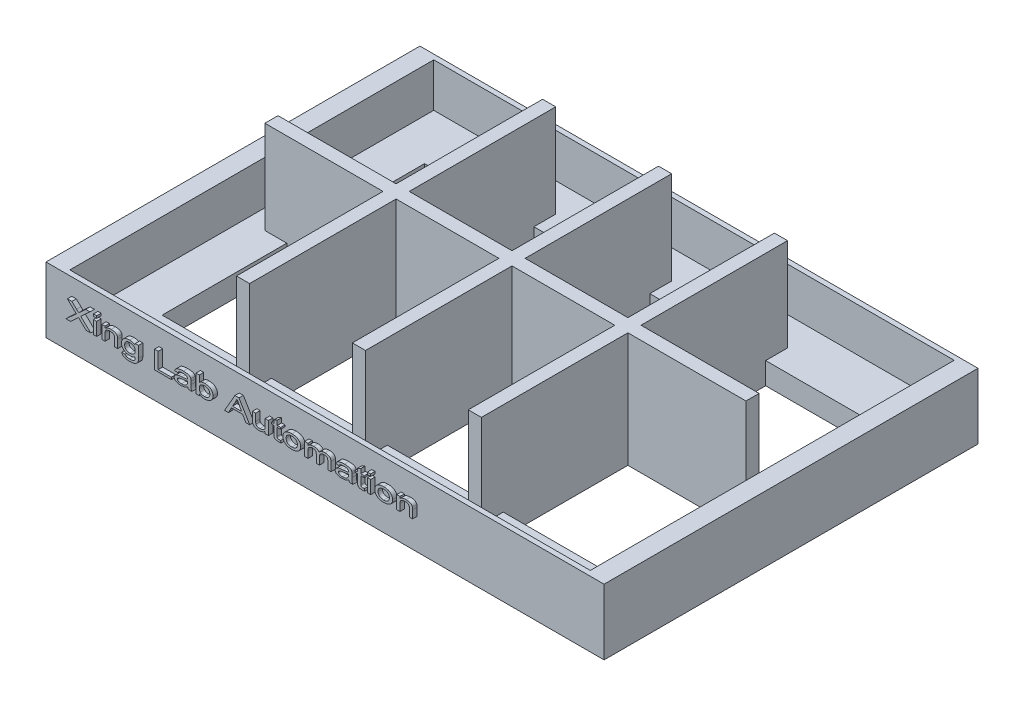
from build123d import *

# Parameters (mm, degrees)
SKETCH_1_W      = 119
SKETCH_1_H      = 83.205034796
EXTRUDE_2_DEPTH = 5
SKETCH_1_4_W    = 119
SKETCH_1_4_H    = 1.145102296
SKETCH_1_4_H_2  = 1.149862908
EXTRUDE_3_DEPTH = 15
SKETCH_2_W      = 0.737568443
SKETCH_2_H      = 0.526834602
SKETCH_2_H_2    = 3.002957231
EXTRUDE_4_DEPTH = 1
SKETCH_1_11_W   = 5
SKETCH_1_11_H   = 3
SKETCH_1_11_W_2 = 22
SKETCH_1_11_W_3 = 3
SKETCH_1_11_H_2 = 28.5
SKETCH_1_11_H_3 = 5
SKETCH_1_11_W_4 = 23.5
EXTRUDE_5_DEPTH = 26.25


with BuildPart() as part:
    # 草图1 → 凸台-拉伸2 (new body)
    with BuildSketch(Plane(origin=(0, 0, 0), x_dir=(1, 0, 0), z_dir=(0, 1, 0))):
        with Locations((0, 0.002380306)):
            Rectangle(SKETCH_1_W, SKETCH_1_H)
        Polygon((-1.5, -35), (-1.5, -30), (-25, -30), (-25, -35), (-28, -35), (-28, -30), (-50, -30), (-50, -1.5), (-55, -1.5), (-55, 1.5), (-50, 1.5), (-50, 30), (-28, 30), (-28, 35), (-25, 35), (-25, 30), (-1.5, 30), (-1.5, 35), (1.5, 35), (1.5, 30), (25, 30), (25, 35), (28, 35), (28, 30), (50, 30), (50, 1.5), (55, 1.5), (55, -1.5), (50, -1.5), (50, -30), (28, -30), (28, -35), (25, -35), (25, -30), (1.5, -30), (1.5, -35), align=None, mode=Mode.SUBTRACT)
    extrude(amount=EXTRUDE_2_DEPTH)

    # 草图1<4> → 凸台-拉伸3 (add)
    with BuildSketch(Plane(origin=(0, 0, 0), x_dir=(1, 0, 0), z_dir=(0, 1, 0))):
        Polygon((-59.5, 41.604897704), (-59.5, 42.75), (-63.8, 42.75), (-63.8, -42.75), (-59.5, -42.75), (-59.5, -41.600137092), align=None)
        with Locations((0, 42.177448852)):
            Rectangle(SKETCH_1_4_W, SKETCH_1_4_H)
        Polygon((63.8, 42.75), (59.5, 42.75), (59.5, 41.604897704), (59.5, -41.600137092), (59.5, -42.75), (63.8, -42.75), align=None)
        with Locations((0, -42.175068546)):
            Rectangle(SKETCH_1_4_W, SKETCH_1_4_H_2)
    extrude(amount=EXTRUDE_3_DEPTH)

    # 草图2 → 凸台-拉伸4 (add)
    # profile 1 of 19: a face of its own
    with BuildSketch(Plane.XY.offset(42.75)):
        with BuildLine():
            Line((-58.222779565, 7.045312338), (-55.862725184, 9.196279236))
            Line((-55.862725184, 9.196279236), (-57.906678804, 11.154622233))
            Line((-57.906678804, 11.154622233), (-56.874412255, 11.154622233))
            Line((-56.874412255, 11.154622233), (-55.80427947, 10.129764297))
            add(Edge.make_bspline(
                [(-55.80427947, 10.129764297), (-55.776867338, 10.103394212), (-55.724000236, 10.052536806), (-55.647903293, 9.98020285), (-55.579463067, 9.913335505), (-55.516395577, 9.854894695), (-55.462075578, 9.800489435), (-55.411904616, 9.755522688), (-55.371374441, 9.714216062), (-55.345311007, 9.690365715), (-55.333421044, 9.679485348)],
                knots=[0, 0, 0, 0, 1.40115503, 2.702270826, 3.867471819, 4.92565285, 5.869199709, 6.698774859, 7.406389885, 8, 8, 8, 8], degree=3))
            add(Edge.make_bspline(
                [(-55.333421044, 9.679485348), (-55.305141704, 9.704985261), (-55.24353872, 9.760533615), (-55.14395698, 9.851109769), (-55.029786474, 9.955654593), (-54.948469984, 10.02963533), (-54.90536793, 10.068849046)],
                knots=[0, 0, 0, 0, 0.789667951, 1.720192303, 2.791580952, 4, 4, 4, 4], degree=3))
            Line((-54.90536793, 10.068849046), (-53.715051001, 11.154622233))
            Line((-53.715051001, 11.154622233), (-52.743699704, 11.154622233))
            Line((-52.743699704, 11.154622233), (-54.842806321, 9.207803743))
            Line((-54.842806321, 9.207803743), (-52.585649323, 7.045312338))
            Line((-52.585649323, 7.045312338), (-53.617915872, 7.045312338))
            Line((-53.617915872, 7.045312338), (-55.137504427, 8.501516105))
            add(Edge.make_bspline(
                [(-55.137504427, 8.501516105), (-55.17839724, 8.540745715), (-55.254720594, 8.613964826), (-55.330957702, 8.687273731), (-55.366348207, 8.721304915)],
                knots=[0, 0, 0, 0, 1.071567501, 2, 2, 2, 2], degree=3))
            add(Edge.make_bspline(
                [(-55.366348207, 8.721304915), (-55.400444233, 8.690101068), (-55.463041607, 8.632813487), (-55.54785454, 8.553223858), (-55.617042019, 8.489353876), (-55.657500542, 8.45132507), (-55.675040357, 8.434838601)],
                knots=[0, 0, 0, 0, 1.316971092, 2.417845725, 3.314095273, 4, 4, 4, 4], degree=3))
            Line((-55.675040357, 8.434838601), (-57.174049435, 7.045312338))
            Line((-57.174049435, 7.045312338), (-58.222779565, 7.045312338))
        make_face()
    # profile 2 of 19: a face of its own
    with BuildSketch(Plane.XY.offset(42.75)):
        with Locations((-51.569846357, 10.891204932)):
            Rectangle(SKETCH_2_W, SKETCH_2_H)
    # profile 3 of 19: a face of its own
    with BuildSketch(Plane.XY.offset(42.75)):
        with Locations((-51.569846357, 8.546790954)):
            Rectangle(SKETCH_2_W, SKETCH_2_H_2)
    # profile 4 of 19: a face of its own
    with BuildSketch(Plane.XY.offset(42.75)):
        with BuildLine():
            Line((-50.04202601, 7.045312338), (-50.04202601, 10.048269569))
            Line((-50.04202601, 10.048269569), (-49.304457567, 10.048269569))
            Line((-49.304457567, 10.048269569), (-49.304457567, 9.629271425))
            add(Edge.make_bspline(
                [(-49.304457567, 9.629271425), (-49.262781892, 9.66709552), (-49.178794098, 9.743321335), (-49.036115213, 9.839087135), (-48.880532784, 9.920256768), (-48.711877168, 9.987373705), (-48.529181407, 10.037443316), (-48.333798921, 10.074623075), (-48.125086331, 10.096971462), (-47.981389961, 10.099601207), (-47.907522693, 10.100953029)],
                knots=[0, 0, 0, 0, 0.892340397, 1.798307998, 2.717783362, 3.673708849, 4.673358127, 5.719693935, 6.827806306, 8, 8, 8, 8], degree=3))
            add(Edge.make_bspline(
                [(-47.907522693, 10.100953029), (-47.842723406, 10.099939814), (-47.715331487, 10.097947888), (-47.52852038, 10.07952472), (-47.349659241, 10.049196737), (-47.180955106, 10.00695563), (-47.026583712, 9.955131337), (-46.889750979, 9.897018592), (-46.775190683, 9.828343111), (-46.67985811, 9.752396211), (-46.602245405, 9.668282712), (-46.537504748, 9.577913154), (-46.484546056, 9.480110212), (-46.460259666, 9.410149475), (-46.44802621, 9.374909094)],
                knots=[0, 0, 0, 0, 1.334802986, 2.624151016, 3.863084231, 5.069710293, 6.203168805, 7.215753571, 8.126171055, 8.946409761, 9.71845364, 10.476206912, 11.2324402, 12, 12, 12, 12], degree=3))
            add(Edge.make_bspline(
                [(-46.44802621, 9.374909094), (-46.44456144, 9.362053485), (-46.437174024, 9.334643376), (-46.429037876, 9.289503302), (-46.423211805, 9.237730759), (-46.415748489, 9.17942795), (-46.412583049, 9.114520588), (-46.408784701, 9.043208519), (-46.407566679, 8.965242831), (-46.40710658, 8.9109098), (-46.406867256, 8.882648012)],
                knots=[0, 0, 0, 0, 0.644987449, 1.375211225, 2.219623254, 3.169655122, 4.222187575, 5.366930599, 6.630386613, 8, 8, 8, 8], degree=3))
            Line((-46.406867256, 8.882648012), (-46.406867256, 7.045312338))
            Line((-46.406867256, 7.045312338), (-47.144435699, 7.045312338))
            Line((-47.144435699, 7.045312338), (-47.144435699, 8.838196343))
            add(Edge.make_bspline(
                [(-47.144435699, 8.838196343), (-47.145494326, 8.885981394), (-47.147472893, 8.975291421), (-47.162943648, 9.100151411), (-47.19141169, 9.205807345), (-47.231073866, 9.295447315), (-47.287725988, 9.37024777), (-47.360225935, 9.435169154), (-47.450309371, 9.491755883), (-47.556641097, 9.539470025), (-47.675924438, 9.578230635), (-47.806179307, 9.607468355), (-47.946635555, 9.623433324), (-48.043583286, 9.625656045), (-48.093561162, 9.626801888)],
                knots=[0, 0, 0, 0, 1.204910874, 2.25197254, 3.163467592, 3.956008041, 4.707432073, 5.510772209, 6.397534482, 7.379034001, 8.442428638, 9.555405936, 10.739778475, 12, 12, 12, 12], degree=3))
            add(Edge.make_bspline(
                [(-48.093561162, 9.626801888), (-48.133906408, 9.626070366), (-48.21360045, 9.624625389), (-48.331115943, 9.61616461), (-48.444091447, 9.598750334), (-48.553346987, 9.578389954), (-48.657819123, 9.548844291), (-48.758533138, 9.514880544), (-48.854579305, 9.472985964), (-48.946342902, 9.426334566), (-49.031977288, 9.371132108), (-49.104688521, 9.301375722), (-49.167249842, 9.221784417), (-49.217915183, 9.130269509), (-49.25734719, 9.027490422), (-49.28484728, 8.913210415), (-49.301288897, 8.787911485), (-49.303373266, 8.700777986), (-49.304457567, 8.65545059)],
                knots=[0, 0, 0, 0, 1.089534928, 2.152160457, 3.177960772, 4.174747821, 5.150777213, 6.106746925, 7.042637586, 7.977119478, 8.885386807, 9.781638081, 10.684236735, 11.609687324, 12.594841562, 13.64786681, 14.776405496, 16, 16, 16, 16], degree=3))
            Line((-49.304457567, 8.65545059), (-49.304457567, 7.045312338))
            Line((-49.304457567, 7.045312338), (-50.04202601, 7.045312338))
        make_face()
    # profile 5 of 19: a face of its own
    with BuildSketch(Plane.XY.offset(42.75)):
        with BuildLine():
            Line((-45.45197954, 6.834578497), (-44.714411097, 6.781895037))
            add(Edge.make_bspline(
                [(-44.714411097, 6.781895037), (-44.710237173, 6.765267192), (-44.702046848, 6.732639031), (-44.681486266, 6.687049238), (-44.656886672, 6.644414494), (-44.626003644, 6.60573564), (-44.590407552, 6.570071035), (-44.549681026, 6.538000546), (-44.504265684, 6.508535525), (-44.470704906, 6.493351329), (-44.453463333, 6.485550573)],
                knots=[0, 0, 0, 0, 1.000066515, 1.962390866, 2.911259237, 3.870505427, 4.845704698, 5.850005269, 6.895457948, 8, 8, 8, 8], degree=3))
            add(Edge.make_bspline(
                [(-44.453463333, 6.485550573), (-44.428666572, 6.475183206), (-44.377658279, 6.453856967), (-44.29528789, 6.430454748), (-44.207525949, 6.407256646), (-44.112399038, 6.390992268), (-44.011482804, 6.376284631), (-43.903654827, 6.368370571), (-43.789537809, 6.360739936), (-43.710971427, 6.360533421), (-43.670620042, 6.360427355)],
                knots=[0, 0, 0, 0, 0.807576017, 1.661227995, 2.57188882, 3.536582376, 4.561249234, 5.637866165, 6.786817335, 8, 8, 8, 8], degree=3))
            add(Edge.make_bspline(
                [(-43.670620042, 6.360427355), (-43.627250814, 6.36052331), (-43.543201199, 6.36070927), (-43.421129533, 6.36840542), (-43.30644438, 6.376196655), (-43.199493114, 6.390973036), (-43.099693257, 6.40710546), (-43.008328415, 6.430321425), (-42.923606906, 6.453947402), (-42.846922633, 6.484180939), (-42.776456207, 6.517064198), (-42.712383625, 6.55319328), (-42.653760134, 6.592205491), (-42.601449866, 6.634710128), (-42.554743504, 6.680361593), (-42.514388855, 6.728846044), (-42.479800738, 6.780728696), (-42.461528146, 6.817622723), (-42.452315025, 6.836224855)],
                knots=[0, 0, 0, 0, 1.509157588, 2.924749178, 4.256469979, 5.508653603, 6.68158384, 7.772642171, 8.788092742, 9.74054915, 10.637771474, 11.493093977, 12.298374084, 13.085958602, 13.835625472, 14.568121415, 15.278040506, 16, 16, 16, 16], degree=3))
            add(Edge.make_bspline(
                [(-42.452315025, 6.836224855), (-42.447409484, 6.849317802), (-42.436639345, 6.878063434), (-42.424722969, 6.926912564), (-42.415238774, 6.985014229), (-42.406876477, 7.052548146), (-42.401703685, 7.129771516), (-42.397320948, 7.216209794), (-42.39605243, 7.31201975), (-42.3962403, 7.378974984), (-42.396338848, 7.414096559)],
                knots=[0, 0, 0, 0, 0.574715752, 1.26179139, 2.063357563, 2.995691196, 4.059541589, 5.245946624, 6.555352761, 8, 8, 8, 8], degree=3))
            add(Edge.make_bspline(
                [(-42.396338848, 7.414096559), (-42.438352049, 7.384478767), (-42.522454496, 7.325189573), (-42.658640557, 7.250417053), (-42.802169811, 7.186936683), (-42.953398203, 7.135045474), (-43.111989659, 7.094708442), (-43.277951759, 7.066166935), (-43.451542172, 7.048431964), (-43.569874364, 7.046366685), (-43.630284268, 7.045312338)],
                knots=[0, 0, 0, 0, 0.940830044, 1.883363045, 2.839568996, 3.812180627, 4.807975686, 5.83327226, 6.893861331, 8, 8, 8, 8], degree=3))
            add(Edge.make_bspline(
                [(-43.630284268, 7.045312338), (-43.704704653, 7.046347422), (-43.84975709, 7.0483649), (-44.060692299, 7.070629594), (-44.259028006, 7.104375085), (-44.444216468, 7.152900821), (-44.616451863, 7.21524676), (-44.775294162, 7.292447891), (-44.922439679, 7.381903847), (-45.054049066, 7.486692927), (-45.171545191, 7.60039186), (-45.275328707, 7.719547026), (-45.362346589, 7.845571084), (-45.433534878, 7.976967193), (-45.489241825, 8.113845641), (-45.529034085, 8.256275247), (-45.552290885, 8.404439979), (-45.555648766, 8.505002832), (-45.55734646, 8.555845923)],
                knots=[0, 0, 0, 0, 1.302582345, 2.538857382, 3.709456856, 4.822366588, 5.886318447, 6.911296292, 7.910005099, 8.895217221, 9.850004907, 10.769784429, 11.657366515, 12.525862541, 13.38146546, 14.239412316, 15.109872908, 16, 16, 16, 16], degree=3))
            add(Edge.make_bspline(
                [(-45.55734646, 8.555845923), (-45.556785445, 8.591269753), (-45.555673817, 8.661460563), (-45.544582663, 8.765740429), (-45.526438617, 8.867726003), (-45.501707501, 8.967564965), (-45.470363147, 9.065313369), (-45.431524268, 9.16104766), (-45.385285189, 9.254676219), (-45.332782871, 9.346342134), (-45.273001577, 9.433817304), (-45.20677014, 9.516718958), (-45.134106994, 9.594340851), (-45.054830732, 9.666611026), (-44.970002317, 9.734609439), (-44.878041612, 9.796322499), (-44.779999151, 9.852945795), (-44.676250926, 9.905012721), (-44.566675736, 9.950834197), (-44.452430662, 9.991284479), (-44.333028145, 10.024991497), (-44.209397351, 10.0529058), (-44.080735884, 10.074210945), (-43.947804622, 10.089887879), (-43.809862361, 10.098908692), (-43.716456493, 10.10026404), (-43.668973684, 10.100953029)],
                knots=[0, 0, 0, 0, 0.930704056, 1.844150468, 2.752315562, 3.651301076, 4.545268904, 5.447833748, 6.36375328, 7.287728051, 8.221806406, 9.145302659, 10.073853049, 11.012983965, 11.962385834, 12.928430141, 13.920396017, 14.936267491, 15.97691996, 17.039748281, 18.119445442, 19.235613089, 20.368979876, 21.5452169, 22.752112678, 24, 24, 24, 24], degree=3))
            add(Edge.make_bspline(
                [(-43.668973684, 10.100953029), (-43.60608376, 10.099741417), (-43.482727005, 10.097364875), (-43.301883806, 10.077136487), (-43.129207697, 10.044486498), (-42.964958978, 9.99846658), (-42.809370841, 9.939230038), (-42.662830428, 9.865875191), (-42.523570569, 9.78105684), (-42.438751051, 9.713343813), (-42.396338848, 9.679485348)],
                knots=[0, 0, 0, 0, 1.102195066, 2.161923522, 3.185490193, 4.179887977, 5.14824547, 6.099061533, 7.049475994, 8, 8, 8, 8], degree=3))
            Line((-42.396338848, 9.679485348), (-42.396338848, 10.048269569))
            Line((-42.396338848, 10.048269569), (-41.658770405, 10.048269569))
            Line((-41.658770405, 10.048269569), (-41.658770405, 7.489005854))
            add(Edge.make_bspline(
                [(-41.658770405, 7.489005854), (-41.65934311, 7.433560747), (-41.660446978, 7.326692252), (-41.670492676, 7.172589551), (-41.686162318, 7.030611302), (-41.710317998, 6.901526251), (-41.73903093, 6.784382754), (-41.776521378, 6.680538079), (-41.818302011, 6.587952791), (-41.870105465, 6.508358785), (-41.928425185, 6.436966561), (-41.993532556, 6.370413348), (-42.066338459, 6.307397066), (-42.147548175, 6.249303114), (-42.235590601, 6.19392486), (-42.331805774, 6.142976915), (-42.435541685, 6.095054332), (-42.547371621, 6.052034721), (-42.665772758, 6.012083856), (-42.791546806, 5.978688094), (-42.92362119, 5.949840114), (-43.062697712, 5.927002306), (-43.207979734, 5.909036475), (-43.360095627, 5.896003138), (-43.518781106, 5.887402476), (-43.626979914, 5.88665653), (-43.682144549, 5.886276213)],
                knots=[0, 0, 0, 0, 1.331751205, 2.566903662, 3.708286618, 4.760664026, 5.719885332, 6.601797317, 7.409764718, 8.153937112, 8.875582325, 9.621387701, 10.387822022, 11.185506766, 12.017660392, 12.884641531, 13.7989424, 14.761058246, 15.761582995, 16.799305081, 17.885329325, 19.007982197, 20.183661604, 21.401080925, 22.674953792, 24, 24, 24, 24], degree=3))
            add(Edge.make_bspline(
                [(-43.682144549, 5.886276213), (-43.747198152, 5.88671099), (-43.874396055, 5.887561099), (-44.060258393, 5.899936178), (-44.23677898, 5.917010292), (-44.403408573, 5.943920246), (-44.560741165, 5.976328516), (-44.708674074, 6.016223693), (-44.846376393, 6.065399895), (-44.974439688, 6.119414973), (-45.090293693, 6.181248355), (-45.190329271, 6.252136353), (-45.275363429, 6.330084264), (-45.343233707, 6.416491744), (-45.396690599, 6.509909398), (-45.431686482, 6.611833137), (-45.452470005, 6.720941279), (-45.452145749, 6.796069155), (-45.45197954, 6.834578497)],
                knots=[0, 0, 0, 0, 1.394318853, 2.726281471, 3.991741937, 5.194796866, 6.342702213, 7.434384059, 8.476243584, 9.474947068, 10.411998632, 11.285227617, 12.096844667, 12.875897124, 13.631798085, 14.392717757, 15.176132951, 16, 16, 16, 16], degree=3))
        make_face()
        with BuildLine():
            add(Edge.make_bspline(
                [(-44.819778018, 8.592065802), (-44.818580062, 8.547024922), (-44.816256941, 8.459679952), (-44.801012868, 8.333264085), (-44.773891629, 8.216520041), (-44.735966783, 8.109252579), (-44.687165858, 8.011287605), (-44.627731785, 7.922442589), (-44.556873758, 7.843424689), (-44.475804255, 7.774446184), (-44.386627842, 7.714671332), (-44.291571606, 7.662945853), (-44.19159864, 7.618005706), (-44.085748073, 7.581872103), (-43.974485533, 7.553918854), (-43.857736716, 7.534541587), (-43.735938177, 7.521668641), (-43.652818366, 7.520207096), (-43.61052797, 7.519463479)],
                knots=[0, 0, 0, 0, 1.176720128, 2.281939986, 3.320025913, 4.301809522, 5.247548094, 6.172074633, 7.085894869, 8.011171485, 8.945649562, 9.885638082, 10.835497302, 11.805776729, 12.803757513, 13.829067201, 14.895454547, 16, 16, 16, 16], degree=3))
            add(Edge.make_bspline(
                [(-43.61052797, 7.519463479), (-43.568249945, 7.520317013), (-43.485454364, 7.521988537), (-43.363731405, 7.533248861), (-43.247722309, 7.554079736), (-43.136841458, 7.582089352), (-43.030947704, 7.617348364), (-42.930134794, 7.661151722), (-42.834457012, 7.713045739), (-42.744643064, 7.772760757), (-42.662666731, 7.841190084), (-42.589882925, 7.918514908), (-42.531100195, 8.007290397), (-42.480642915, 8.103146304), (-42.443508446, 8.209015679), (-42.414841556, 8.322939528), (-42.399933741, 8.4465211), (-42.397562477, 8.531665599), (-42.396338848, 8.575602221)],
                knots=[0, 0, 0, 0, 1.111496976, 2.176710881, 3.209708351, 4.206976273, 5.181041069, 6.140573195, 7.092810464, 8.039154864, 8.971092712, 9.89503937, 10.819408339, 11.761509144, 12.735894426, 13.761155494, 14.844702057, 16, 16, 16, 16], degree=3))
            add(Edge.make_bspline(
                [(-42.396338848, 8.575602221), (-42.39743961, 8.617913081), (-42.399571393, 8.699854076), (-42.416188934, 8.818843999), (-42.444130738, 8.929876773), (-42.483284239, 9.033331158), (-42.53527827, 9.128035804), (-42.597103463, 9.21538257), (-42.671116691, 9.293883281), (-42.755336361, 9.363692419), (-42.847705974, 9.424603022), (-42.944449874, 9.479409913), (-43.046745243, 9.524495561), (-43.152710748, 9.562773811), (-43.263842323, 9.591429555), (-43.379421895, 9.611902689), (-43.499667599, 9.624513441), (-43.581411629, 9.626031741), (-43.622875656, 9.626801888)],
                knots=[0, 0, 0, 0, 1.114720679, 2.15881507, 3.158470241, 4.126692766, 5.065049969, 5.998098572, 6.939404404, 7.899492284, 8.874173644, 9.851827785, 10.826106723, 11.816434219, 12.81789229, 13.846243382, 14.907523623, 16, 16, 16, 16], degree=3))
            add(Edge.make_bspline(
                [(-43.622875656, 9.626801888), (-43.663790405, 9.626034622), (-43.744165554, 9.624527363), (-43.862244333, 9.611973701), (-43.975215445, 9.591204078), (-44.084014681, 9.563698994), (-44.187646265, 9.525884225), (-44.287833314, 9.482336419), (-44.381722379, 9.427602004), (-44.471522717, 9.36781308), (-44.553357877, 9.298827874), (-44.624531015, 9.220928759), (-44.685028337, 9.135472429), (-44.735335257, 9.042326431), (-44.77267867, 8.940404174), (-44.799769079, 8.831110348), (-44.816556653, 8.714136429), (-44.818683101, 8.633556647), (-44.819778018, 8.592065802)],
                knots=[0, 0, 0, 0, 1.100126261, 2.161147634, 3.188798452, 4.18750765, 5.1748108, 6.152581528, 7.120950933, 8.093136588, 9.05121713, 9.991368739, 10.922967255, 11.860566936, 12.829610889, 13.833649184, 14.884537489, 16, 16, 16, 16], degree=3))
        make_face(mode=Mode.SUBTRACT)
    # profile 6 of 19: a face of its own
    with BuildSketch(Plane.XY.offset(42.75)):
        Polygon((-37.977513624, 7.045312338), (-37.977513624, 11.154622233), (-37.134578261, 11.154622233), (-37.134578261, 7.519463479), (-34.131621029, 7.519463479), (-34.131621029, 7.045312338), align=None)
    # profile 7 of 19: a face of its own
    with BuildSketch(Plane.XY.offset(42.75)):
        with BuildLine():
            add(Edge.make_bspline(
                [(-30.391095355, 7.414096559), (-30.459280017, 7.377602847), (-30.592450612, 7.306327442), (-30.794494964, 7.215693164), (-30.992127584, 7.141943478), (-31.18723304, 7.085056748), (-31.383576368, 7.043776556), (-31.584544515, 7.014443369), (-31.79260876, 6.995574826), (-31.933691665, 6.993621166), (-32.005349502, 6.992628877)],
                knots=[0, 0, 0, 0, 1.099122326, 2.146681806, 3.145131152, 4.095639367, 5.032808011, 5.994867275, 6.981567089, 8, 8, 8, 8], degree=3))
            add(Edge.make_bspline(
                [(-32.005349502, 6.992628877), (-32.063534327, 6.99353618), (-32.176711038, 6.995300997), (-32.341360238, 7.00555517), (-32.495812842, 7.024475309), (-32.63978484, 7.050820367), (-32.773817231, 7.083031856), (-32.896840487, 7.124298146), (-33.009561719, 7.172896882), (-33.111582636, 7.228553189), (-33.20219009, 7.290506074), (-33.281912448, 7.355812509), (-33.348502024, 7.426640386), (-33.40341858, 7.501162515), (-33.447165181, 7.580047866), (-33.477405124, 7.663699148), (-33.496450476, 7.751290689), (-33.498420944, 7.811045095), (-33.499419507, 7.841326494)],
                knots=[0, 0, 0, 0, 1.467352503, 2.854182901, 4.157889263, 5.388888655, 6.543520828, 7.631035463, 8.656833932, 9.635406056, 10.55664219, 11.421336781, 12.229029369, 13.001295773, 13.750686536, 14.494980542, 15.237309901, 16, 16, 16, 16], degree=3))
            add(Edge.make_bspline(
                [(-33.499419507, 7.841326494), (-33.497818623, 7.87720368), (-33.494640021, 7.948438934), (-33.46467463, 8.05181294), (-33.419260338, 8.150778735), (-33.353846048, 8.242371283), (-33.275114106, 8.327668194), (-33.183558304, 8.404203057), (-33.082035665, 8.473380383), (-32.968193619, 8.531026489), (-32.845707746, 8.581599663), (-32.715339677, 8.62595942), (-32.577661908, 8.664116633), (-32.48265067, 8.68345867), (-32.434225796, 8.693316827)],
                knots=[0, 0, 0, 0, 0.871887231, 1.731158875, 2.60120008, 3.513317807, 4.45918451, 5.421829971, 6.413476087, 7.44468695, 8.52321132, 9.63908277, 10.796698974, 12, 12, 12, 12], degree=3))
            add(Edge.make_bspline(
                [(-32.434225796, 8.693316827), (-32.414752349, 8.696657203), (-32.373669194, 8.703704398), (-32.308423389, 8.713857766), (-32.236082742, 8.722153432), (-32.157209129, 8.732770765), (-32.071174063, 8.741064923), (-31.978280902, 8.751632913), (-31.87804704, 8.760196616), (-31.808884026, 8.76603707), (-31.773213006, 8.769049301)],
                knots=[0, 0, 0, 0, 0.7124815, 1.503123103, 2.380626033, 3.337901957, 4.372682653, 5.497061812, 6.709102535, 8, 8, 8, 8], degree=3))
            add(Edge.make_bspline(
                [(-31.773213006, 8.769049301), (-31.700769525, 8.775313269), (-31.560511144, 8.787440984), (-31.357611053, 8.805756372), (-31.169670047, 8.826484811), (-30.996856347, 8.848110809), (-30.838344041, 8.868902511), (-30.694852658, 8.892034342), (-30.566016237, 8.915447308), (-30.485711037, 8.933442726), (-30.44789471, 8.941916905)],
                knots=[0, 0, 0, 0, 1.30468558, 2.52601179, 3.655261562, 4.697057442, 5.650966829, 6.52351024, 7.304709779, 8, 8, 8, 8], degree=3))
            add(Edge.make_bspline(
                [(-30.44789471, 8.941916905), (-30.44739133, 8.956461913), (-30.446479398, 8.982811943), (-30.444667574, 9.017913316), (-30.443660812, 9.044259772), (-30.443745335, 9.058807923), (-30.443778815, 9.064570586)],
                knots=[0, 0, 0, 0, 1.422878145, 2.577714779, 3.436619076, 4, 4, 4, 4], degree=3))
            add(Edge.make_bspline(
                [(-30.443778815, 9.064570586), (-30.444353888, 9.087658898), (-30.445461872, 9.132142723), (-30.455541992, 9.19624132), (-30.471885157, 9.255209895), (-30.494915376, 9.309050029), (-30.524652736, 9.357813059), (-30.562545854, 9.399671344), (-30.605564318, 9.437666594), (-30.638526609, 9.457708099), (-30.655335835, 9.467928328)],
                knots=[0, 0, 0, 0, 1.1536287, 2.222675128, 3.234567423, 4.205458348, 5.141915443, 6.074950024, 7.018314641, 8, 8, 8, 8], degree=3))
            add(Edge.make_bspline(
                [(-30.655335835, 9.467928328), (-30.68034767, 9.48079545), (-30.732256818, 9.507499661), (-30.817900899, 9.538681264), (-30.911194763, 9.566872757), (-31.013654121, 9.588874786), (-31.12444516, 9.605874164), (-31.244235259, 9.618049542), (-31.372504174, 9.625487613), (-31.46094326, 9.626355033), (-31.506502989, 9.626801888)],
                knots=[0, 0, 0, 0, 0.771401897, 1.600954748, 2.496984787, 3.445485948, 4.474542614, 5.572519321, 6.749474194, 8, 8, 8, 8], degree=3))
            add(Edge.make_bspline(
                [(-31.506502989, 9.626801888), (-31.549038904, 9.626509939), (-31.631123053, 9.625946547), (-31.74999847, 9.620971796), (-31.860373827, 9.612864886), (-31.962311798, 9.601668311), (-32.055336619, 9.58664368), (-32.139981013, 9.57000814), (-32.215822199, 9.548463763), (-32.284281922, 9.523884816), (-32.346216926, 9.494529654), (-32.403262539, 9.460989094), (-32.455525717, 9.421572096), (-32.504292961, 9.378052504), (-32.548865054, 9.329164149), (-32.589553951, 9.275269787), (-32.625612624, 9.21608369), (-32.646116228, 9.173954115), (-32.656484143, 9.152650746)],
                knots=[0, 0, 0, 0, 1.538696914, 2.969317239, 4.303133498, 5.541808666, 6.677616391, 7.711329472, 8.660312252, 9.52702798, 10.339587239, 11.136288664, 11.916494485, 12.703740655, 13.497654562, 14.305653797, 15.143231738, 16, 16, 16, 16], degree=3))
            Line((-32.656484143, 9.152650746), (-33.394052586, 9.205334206))
            add(Edge.make_bspline(
                [(-33.394052586, 9.205334206), (-33.37595365, 9.255050702), (-33.340472816, 9.352514043), (-33.264494721, 9.486287538), (-33.17179546, 9.604315068), (-33.08222377, 9.691414203), (-33.00082299, 9.752591573), (-32.933353661, 9.796440165), (-32.858514633, 9.836278122), (-32.778554647, 9.875433755), (-32.691084448, 9.909335049), (-32.598355267, 9.942799917), (-32.498398536, 9.971962468), (-32.354629639, 10.008791876), (-32.162193077, 10.046752533), (-31.916915691, 10.078389562), (-31.654422239, 10.097212915), (-31.473607429, 10.099682258), (-31.380556591, 10.100953029)],
                knots=[0, 0, 0, 0, 1.072817813, 2.103133121, 3.107253628, 4.11199215, 4.628999136, 5.172949408, 5.743848997, 6.349363435, 6.97939556, 7.647212873, 8.350524322, 9.092344716, 10.660213573, 12.329047941, 14.110856293, 16, 16, 16, 16], degree=3))
            add(Edge.make_bspline(
                [(-31.380556591, 10.100953029), (-31.334180934, 10.100592094), (-31.24333245, 10.099885032), (-31.110499, 10.095687364), (-30.984213321, 10.089372283), (-30.864759628, 10.079714085), (-30.752067953, 10.066024474), (-30.645919846, 10.051935665), (-30.546494532, 10.033720467), (-30.453829152, 10.012183289), (-30.367082462, 9.989102825), (-30.286485224, 9.964781091), (-30.212096167, 9.93786515), (-30.14301824, 9.911429799), (-30.080188673, 9.882327679), (-30.023222797, 9.85234104), (-29.972863464, 9.819624669), (-29.912653667, 9.776729037), (-29.848143337, 9.714943891), (-29.781515892, 9.63371037), (-29.728460781, 9.542056261), (-29.703897437, 9.476024234), (-29.691393149, 9.442409777)],
                knots=[0, 0, 0, 0, 1.439796539, 2.820517066, 4.125690756, 5.365155513, 6.540178449, 7.649764385, 8.689071359, 9.67686088, 10.602604169, 11.475698901, 12.289422009, 13.058250654, 13.771044678, 14.438026885, 15.054810062, 15.634158552, 16.731081884, 17.815395527, 18.887898845, 20, 20, 20, 20], degree=3))
            add(Edge.make_bspline(
                [(-29.691393149, 9.442409777), (-29.68817706, 9.430654957), (-29.68120844, 9.405184619), (-29.674435643, 9.362940506), (-29.667826019, 9.314368504), (-29.662005922, 9.259209994), (-29.657979502, 9.197152017), (-29.655849686, 9.128515293), (-29.654110963, 9.053328615), (-29.653726973, 9.001186958), (-29.653526912, 8.974020889)],
                knots=[0, 0, 0, 0, 0.620412976, 1.344310591, 2.176564568, 3.118193958, 4.168877629, 5.343785579, 6.616098728, 8, 8, 8, 8], degree=3))
            Line((-29.653526912, 8.974020889), (-29.653526912, 8.294898159))
            add(Edge.make_bspline(
                [(-29.653526912, 8.294898159), (-29.653306122, 8.238372844), (-29.652885969, 8.130807758), (-29.651458858, 7.977685924), (-29.648414621, 7.841285219), (-29.643148799, 7.721117467), (-29.638071792, 7.617312221), (-29.630407902, 7.52979475), (-29.622945189, 7.458801786), (-29.609907891, 7.386032524), (-29.586776008, 7.306889832), (-29.549013151, 7.217179606), (-29.501597682, 7.128982777), (-29.462586963, 7.073476177), (-29.442793071, 7.045312338)],
                knots=[0, 0, 0, 0, 1.574527015, 2.996252761, 4.265399722, 5.374618653, 6.346784129, 7.159883148, 7.821631042, 8.334355502, 9.217307448, 10.111567109, 11.041816277, 12, 12, 12, 12], degree=3))
            Line((-29.442793071, 7.045312338), (-30.180361514, 7.045312338))
            add(Edge.make_bspline(
                [(-30.180361514, 7.045312338), (-30.206305348, 7.071962003), (-30.257155433, 7.124195522), (-30.316039248, 7.215341643), (-30.364242555, 7.310878758), (-30.382130738, 7.37963803), (-30.391095355, 7.414096559)],
                knots=[0, 0, 0, 0, 1.033656025, 2.025972594, 3.010721338, 4, 4, 4, 4], degree=3))
        make_face()
        with BuildLine():
            add(Edge.make_bspline(
                [(-30.443778815, 8.573132684), (-30.480470579, 8.563215646), (-30.557852348, 8.542300927), (-30.681642375, 8.515880536), (-30.818047748, 8.489572387), (-30.967372717, 8.464192502), (-31.129503056, 8.43931934), (-31.304965731, 8.416754753), (-31.493150496, 8.394217691), (-31.623094209, 8.381369139), (-31.69007192, 8.374746529)],
                knots=[0, 0, 0, 0, 0.721922124, 1.522510893, 2.403733928, 3.360953104, 4.399674802, 5.519511503, 6.721466088, 8, 8, 8, 8], degree=3))
            add(Edge.make_bspline(
                [(-31.69007192, 8.374746529), (-31.727955204, 8.371060829), (-31.800765151, 8.363977083), (-31.905248384, 8.351301281), (-32.001107356, 8.33931802), (-32.088313058, 8.32595715), (-32.167353219, 8.31282977), (-32.238019839, 8.300032631), (-32.29988164, 8.286256259), (-32.369176249, 8.266694982), (-32.445370825, 8.239789714), (-32.527386715, 8.201293662), (-32.597940811, 8.155157377), (-32.656822338, 8.102408537), (-32.703573841, 8.044653975), (-32.737002405, 7.983020629), (-32.758263896, 7.917883125), (-32.760646885, 7.873041145), (-32.761851064, 7.850381464)],
                knots=[0, 0, 0, 0, 1.403982305, 2.698390033, 3.882298214, 4.967366097, 5.952465249, 6.837879649, 7.616274152, 8.289204687, 9.492979422, 10.593097249, 11.623388323, 12.590910465, 13.498269283, 14.349707251, 15.166069194, 16, 16, 16, 16], degree=3))
            add(Edge.make_bspline(
                [(-32.761851064, 7.850381464), (-32.761397166, 7.833283272), (-32.76049315, 7.799229228), (-32.747725087, 7.749980467), (-32.731190778, 7.701911694), (-32.704451221, 7.657504212), (-32.672549313, 7.613855775), (-32.631616429, 7.574287338), (-32.584871587, 7.535534588), (-32.530701101, 7.499896807), (-32.469894753, 7.466593201), (-32.401367528, 7.439115228), (-32.327151094, 7.413970064), (-32.245300147, 7.395858663), (-32.157806361, 7.379808871), (-32.063163821, 7.369592564), (-31.962093115, 7.362882894), (-31.892311569, 7.361912915), (-31.856354091, 7.361413099)],
                knots=[0, 0, 0, 0, 0.720378718, 1.434760423, 2.139097264, 2.861060566, 3.614729439, 4.418215413, 5.258506159, 6.178238756, 7.153590206, 8.182862614, 9.293857899, 10.461033616, 11.721096359, 13.051482321, 14.480669103, 16, 16, 16, 16], degree=3))
            add(Edge.make_bspline(
                [(-31.856354091, 7.361413099), (-31.784936087, 7.362902236), (-31.645767796, 7.365804035), (-31.443258832, 7.390982772), (-31.252935914, 7.43164928), (-31.103685002, 7.480203001), (-30.99197839, 7.526277729), (-30.914649569, 7.564313198), (-30.842576732, 7.60446134), (-30.776523088, 7.648194137), (-30.716097883, 7.695114334), (-30.661902427, 7.745520843), (-30.612493184, 7.798132153), (-30.584451908, 7.8363642), (-30.570548391, 7.855320538)],
                knots=[0, 0, 0, 0, 1.801166242, 3.509832461, 5.139182318, 6.704404972, 7.461614056, 8.186060329, 8.877265603, 9.541567819, 10.182707247, 10.804842062, 11.407412898, 12, 12, 12, 12], degree=3))
            add(Edge.make_bspline(
                [(-30.570548391, 7.855320538), (-30.560544578, 7.87073835), (-30.539969455, 7.902448596), (-30.516058835, 7.955729057), (-30.494186482, 8.013550018), (-30.477351673, 8.076768439), (-30.464177302, 8.145284826), (-30.454397563, 8.218929356), (-30.448597024, 8.298096661), (-30.448133309, 8.352510721), (-30.44789471, 8.380508782)],
                knots=[0, 0, 0, 0, 0.80506362, 1.655796908, 2.554556615, 3.515177287, 4.520741764, 5.613568228, 6.77209193, 8, 8, 8, 8], degree=3))
            Line((-30.44789471, 8.380508782), (-30.443778815, 8.573132684))
        make_face(mode=Mode.SUBTRACT)
    # profile 8 of 19: a face of its own
    with BuildSketch(Plane.XY.offset(42.75)):
        with BuildLine():
            Line((-27.756922344, 7.045312338), (-28.494490787, 7.045312338))
            Line((-28.494490787, 7.045312338), (-28.494490787, 11.154622233))
            Line((-28.494490787, 11.154622233), (-27.756922344, 11.154622233))
            Line((-27.756922344, 11.154622233), (-27.756922344, 9.64244229))
            add(Edge.make_bspline(
                [(-27.756922344, 9.64244229), (-27.715686233, 9.679308716), (-27.633844951, 9.752477488), (-27.498428852, 9.845515089), (-27.35482114, 9.924171882), (-27.203335406, 9.989325904), (-27.043152274, 10.039980202), (-26.874586879, 10.074741291), (-26.697797469, 10.096758379), (-26.577098822, 10.099536687), (-26.515568313, 10.100953029)],
                knots=[0, 0, 0, 0, 0.977757563, 1.940554762, 2.898641239, 3.870682322, 4.853248164, 5.865290131, 6.911754298, 8, 8, 8, 8], degree=3))
            add(Edge.make_bspline(
                [(-26.515568313, 10.100953029), (-26.446631926, 10.099887686), (-26.310609461, 10.097785594), (-26.109621112, 10.075056329), (-25.914159163, 10.041145883), (-25.725958964, 9.992752456), (-25.548505376, 9.932715094), (-25.385392486, 9.861576122), (-25.239143984, 9.778224595), (-25.109650088, 9.682484539), (-24.994528287, 9.576777444), (-24.893282435, 9.460298289), (-24.804641613, 9.333838975), (-24.730143473, 9.197356951), (-24.669799076, 9.053817235), (-24.626723394, 8.904139851), (-24.600359404, 8.749409305), (-24.597405823, 8.644304098), (-24.595914732, 8.591242623)],
                knots=[0, 0, 0, 0, 1.208265405, 2.384099963, 3.5421602, 4.684603166, 5.787707206, 6.823860827, 7.80018826, 8.732662222, 9.641806186, 10.535269982, 11.433565791, 12.344388739, 13.256697295, 14.15815726, 15.070161273, 16, 16, 16, 16], degree=3))
            add(Edge.make_bspline(
                [(-24.595914732, 8.591242623), (-24.597659452, 8.529413258), (-24.601072383, 8.408465842), (-24.627543999, 8.232456161), (-24.672176385, 8.067331177), (-24.73400366, 7.912778915), (-24.8143609, 7.769511312), (-24.91282406, 7.637283263), (-25.028492487, 7.515745705), (-25.161522462, 7.407273664), (-25.305660184, 7.309985473), (-25.458332214, 7.225084534), (-25.617955879, 7.152940933), (-25.785043609, 7.094769545), (-25.958801411, 7.048133761), (-26.140130424, 7.01681511), (-26.327955571, 6.996197515), (-26.455694366, 6.993830082), (-26.520507388, 6.992628877)],
                knots=[0, 0, 0, 0, 1.056441619, 2.066556626, 3.033555351, 3.974081829, 4.904226994, 5.832798438, 6.784806514, 7.764155861, 8.760503601, 9.75350152, 10.746322237, 11.750453719, 12.774236792, 13.817438326, 14.892596282, 16, 16, 16, 16], degree=3))
            add(Edge.make_bspline(
                [(-26.520507388, 6.992628877), (-26.584506478, 6.99428402), (-26.70936532, 6.997513116), (-26.891439172, 7.020488975), (-27.062700461, 7.060012985), (-27.223454313, 7.115150154), (-27.373623169, 7.186501563), (-27.513313406, 7.273099991), (-27.642552382, 7.375831098), (-27.718562828, 7.455423897), (-27.756922344, 7.495591287)],
                knots=[0, 0, 0, 0, 1.115319119, 2.175928669, 3.192146744, 4.17369932, 5.132049526, 6.083561856, 7.032848198, 8, 8, 8, 8], degree=3))
            Line((-27.756922344, 7.495591287), (-27.756922344, 7.045312338))
        make_face()
        with BuildLine():
            add(Edge.make_bspline(
                [(-27.756922344, 8.568193609), (-27.756417704, 8.527282095), (-27.755443778, 8.448325331), (-27.744443869, 8.334472862), (-27.72746978, 8.229605794), (-27.703921507, 8.13326313), (-27.672490457, 8.04564197), (-27.635006142, 7.966437817), (-27.590443478, 7.895626554), (-27.554190709, 7.855403026), (-27.536310355, 7.835564241)],
                knots=[0, 0, 0, 0, 1.252470525, 2.417192845, 3.498841117, 4.503566248, 5.449769494, 6.344264849, 7.18336914, 8, 8, 8, 8], degree=3))
            add(Edge.make_bspline(
                [(-27.536310355, 7.835564241), (-27.505689715, 7.805986228), (-27.444681325, 7.747055163), (-27.341535716, 7.672470714), (-27.231392549, 7.608355061), (-27.112862965, 7.556412933), (-26.986454846, 7.516159484), (-26.852202865, 7.487484234), (-26.710033534, 7.469874842), (-26.612481235, 7.467828625), (-26.56248952, 7.466780019)],
                knots=[0, 0, 0, 0, 0.953367827, 1.899484694, 2.844821374, 3.806035168, 4.794267259, 5.813765251, 6.879640698, 8, 8, 8, 8], degree=3))
            add(Edge.make_bspline(
                [(-26.56248952, 7.466780019), (-26.521560851, 7.467450706), (-26.44058306, 7.468777667), (-26.321598692, 7.482918634), (-26.206192037, 7.502467257), (-26.096153849, 7.533712677), (-25.98963434, 7.571429855), (-25.887743723, 7.618355844), (-25.790192764, 7.674005316), (-25.69710304, 7.736765665), (-25.611511864, 7.808521139), (-25.536801531, 7.889849839), (-25.473607659, 7.979465607), (-25.422572491, 8.077673055), (-25.381598721, 8.183507837), (-25.354359844, 8.298464789), (-25.336512619, 8.421107989), (-25.33450961, 8.505839937), (-25.333483175, 8.549260491)],
                knots=[0, 0, 0, 0, 1.063653351, 2.104449013, 3.112070372, 4.10388203, 5.074292161, 6.047975186, 7.016100852, 7.991690168, 8.963672663, 9.912976329, 10.855175457, 11.806193442, 12.784049785, 13.798066567, 14.871627874, 16, 16, 16, 16], degree=3))
            add(Edge.make_bspline(
                [(-25.333483175, 8.549260491), (-25.334594284, 8.593763641), (-25.336755921, 8.680343481), (-25.353288061, 8.805548917), (-25.380328349, 8.921731131), (-25.417935968, 9.029009278), (-25.468019033, 9.126910338), (-25.528004073, 9.216397707), (-25.599692974, 9.296563841), (-25.682531793, 9.365808039), (-25.772071643, 9.426935319), (-25.866114861, 9.481236513), (-25.965567334, 9.525141436), (-26.069023021, 9.562921378), (-26.177413546, 9.591222143), (-26.2901985, 9.611939976), (-26.407444746, 9.624537387), (-26.487274572, 9.62603795), (-26.527915999, 9.626801888)],
                knots=[0, 0, 0, 0, 1.172449849, 2.280973832, 3.320999251, 4.31127443, 5.268448283, 6.211008777, 7.142942796, 8.091915716, 9.048597856, 9.997460584, 10.948936923, 11.90954572, 12.896965854, 13.896803547, 14.929261008, 16, 16, 16, 16], degree=3))
            add(Edge.make_bspline(
                [(-26.527915999, 9.626801888), (-26.568838403, 9.626099188), (-26.649803797, 9.624708889), (-26.768927904, 9.611024548), (-26.883981492, 9.58978886), (-26.994596904, 9.559975869), (-27.101220934, 9.522514395), (-27.202922269, 9.474696578), (-27.30122986, 9.420030471), (-27.393567305, 9.35578932), (-27.479503917, 9.285476208), (-27.553547431, 9.205153665), (-27.616590966, 9.117647625), (-27.667655058, 9.021940992), (-27.708694073, 8.919443737), (-27.735888935, 8.808855886), (-27.75397061, 8.691167724), (-27.755919503, 8.60997363), (-27.756922344, 8.568193609)],
                knots=[0, 0, 0, 0, 1.076704338, 2.130270525, 3.15155853, 4.153641622, 5.142758237, 6.121830915, 7.108122269, 8.099766848, 9.079025968, 10.0244643, 10.966448232, 11.910008939, 12.872939663, 13.864373824, 14.901071482, 16, 16, 16, 16], degree=3))
        make_face(mode=Mode.SUBTRACT)
    # profile 9 of 19: a face of its own
    with BuildSketch(Plane.XY.offset(42.75)):
        Polygon((-21.959272185, 7.045312338), (-19.607449594, 11.154622233), (-18.690428115, 11.154622233), (-16.216775023, 7.045312338), (-17.114863383, 7.045312338), (-17.819504664, 8.309715383), (-20.397701497, 8.309715383), (-21.066122899, 7.045312338), align=None)
        with BuildLine():
            Line((-20.145808703, 8.783866524), (-18.085391502, 8.783866524))
            Line((-18.085391502, 8.783866524), (-18.684665862, 9.857292026))
            add(Edge.make_bspline(
                [(-18.684665862, 9.857292026), (-18.707951434, 9.899295227), (-18.753333809, 9.981157291), (-18.820188628, 10.100266773), (-18.882604756, 10.213275846), (-18.941867678, 10.319470177), (-18.997927355, 10.418874101), (-19.049825629, 10.511873461), (-19.097446504, 10.598527848), (-19.128331542, 10.653870398), (-19.143176601, 10.680471092)],
                knots=[0, 0, 0, 0, 1.22324671, 2.384044489, 3.478993058, 4.511491318, 5.481547101, 6.385746022, 7.224100153, 8, 8, 8, 8], degree=3))
            add(Edge.make_bspline(
                [(-19.143176601, 10.680471092), (-19.166831679, 10.617986043), (-19.214816255, 10.491234459), (-19.296922978, 10.302404558), (-19.386578743, 10.110593041), (-19.452251638, 9.983569362), (-19.485619093, 9.919030456)],
                knots=[0, 0, 0, 0, 0.959498805, 1.946353512, 2.956571724, 4, 4, 4, 4], degree=3))
            Line((-19.485619093, 9.919030456), (-20.145808703, 8.783866524))
        make_face(mode=Mode.SUBTRACT)
    # profile 10 of 19: a face of its own
    with BuildSketch(Plane.XY.offset(42.75)):
        with BuildLine():
            Line((-12.689452726, 7.045312338), (-12.689452726, 7.535927061))
            add(Edge.make_bspline(
                [(-12.689452726, 7.535927061), (-12.733204138, 7.492305937), (-12.820137271, 7.405631684), (-12.967512944, 7.29524401), (-13.125794798, 7.201684183), (-13.295440564, 7.124640351), (-13.476717826, 7.065725143), (-13.669025012, 7.022768908), (-13.873025688, 6.996911468), (-14.013048236, 6.994079086), (-14.084741243, 6.992628877)],
                knots=[0, 0, 0, 0, 0.961047374, 1.909580863, 2.857777489, 3.819584375, 4.804562292, 5.820406475, 6.884025352, 8, 8, 8, 8], degree=3))
            add(Edge.make_bspline(
                [(-14.084741243, 6.992628877), (-14.148451459, 6.993900944), (-14.273961669, 6.996406936), (-14.459053321, 7.016044728), (-14.638106326, 7.046607347), (-14.807817621, 7.091149828), (-14.964201209, 7.142700121), (-15.100794085, 7.203778666), (-15.216830273, 7.26984352), (-15.312522569, 7.34428325), (-15.389388932, 7.427918717), (-15.453373388, 7.518331159), (-15.505455108, 7.617424033), (-15.529534475, 7.688383531), (-15.541768189, 7.724435067)],
                knots=[0, 0, 0, 0, 1.312068318, 2.584796937, 3.829967901, 5.050050954, 6.195756992, 7.217851214, 8.127155698, 8.940155915, 9.704027323, 10.458324315, 11.216739429, 12, 12, 12, 12], degree=3))
            add(Edge.make_bspline(
                [(-15.541768189, 7.724435067), (-15.54894303, 7.752860381), (-15.56493115, 7.816202185), (-15.576908625, 7.924220475), (-15.586499572, 8.053252065), (-15.586853009, 8.146697805), (-15.587043038, 8.196939851)],
                knots=[0, 0, 0, 0, 0.738320001, 1.645242031, 2.733940592, 4, 4, 4, 4], degree=3))
            Line((-15.587043038, 8.196939851), (-15.587043038, 10.048269569))
            Line((-15.587043038, 10.048269569), (-14.849474595, 10.048269569))
            Line((-14.849474595, 10.048269569), (-14.849474595, 8.415082303))
            add(Edge.make_bspline(
                [(-14.849474595, 8.415082303), (-14.849370288, 8.383797615), (-14.849170789, 8.323961738), (-14.846203726, 8.238094389), (-14.843846887, 8.160331491), (-14.837314766, 8.090437498), (-14.831598713, 8.02852139), (-14.822745454, 7.974581944), (-14.814911195, 7.928234273), (-14.805866196, 7.900794861), (-14.801730209, 7.888247701)],
                knots=[0, 0, 0, 0, 1.414532032, 2.705469422, 3.885245162, 4.931104475, 5.879299453, 6.695288413, 7.4033974, 8, 8, 8, 8], degree=3))
            add(Edge.make_bspline(
                [(-14.801730209, 7.888247701), (-14.787507899, 7.856392184), (-14.758753232, 7.791986696), (-14.687764072, 7.708924002), (-14.598980626, 7.635278891), (-14.489652354, 7.574375416), (-14.363489888, 7.52684861), (-14.223055874, 7.491052763), (-14.068570802, 7.471153236), (-13.961045248, 7.468273367), (-13.905288206, 7.466780019)],
                knots=[0, 0, 0, 0, 0.793680314, 1.604662927, 2.468614835, 3.420681825, 4.449022146, 5.542599918, 6.725722821, 8, 8, 8, 8], degree=3))
            add(Edge.make_bspline(
                [(-13.905288206, 7.466780019), (-13.84787615, 7.468239167), (-13.734568974, 7.471118909), (-13.56724214, 7.492950678), (-13.405625044, 7.529355088), (-13.275477156, 7.570743051), (-13.177348838, 7.611209643), (-13.108846513, 7.64327192), (-13.046372886, 7.678903417), (-12.988759992, 7.716275255), (-12.936984285, 7.756821689), (-12.892057204, 7.800873667), (-12.850890526, 7.846043367), (-12.815930099, 7.895305386), (-12.786359644, 7.948885193), (-12.759375415, 8.006564727), (-12.738637167, 8.070651891), (-12.720285764, 8.139813429), (-12.706441555, 8.214957009), (-12.697103173, 8.295547414), (-12.689832888, 8.3814767), (-12.689582053, 8.440583846), (-12.689452726, 8.471058479)],
                knots=[0, 0, 0, 0, 1.903356927, 3.756423533, 5.584120489, 7.391091229, 8.276459012, 9.10262438, 9.897120133, 10.659228002, 11.378242881, 12.073194976, 12.743405974, 13.402343745, 14.070451631, 14.770743656, 15.510192386, 16.300247391, 17.14253821, 18.040854792, 18.989898258, 20, 20, 20, 20], degree=3))
            Line((-12.689452726, 8.471058479), (-12.689452726, 10.048269569))
            Line((-12.689452726, 10.048269569), (-11.951884284, 10.048269569))
            Line((-11.951884284, 10.048269569), (-11.951884284, 7.045312338))
            Line((-11.951884284, 7.045312338), (-12.689452726, 7.045312338))
        make_face()
    # profile 11 of 19: a face of its own
    with BuildSketch(Plane.XY.offset(42.75)):
        with BuildLine():
            Line((-9.159660893, 7.479950884), (-9.054293972, 7.037903726))
            add(Edge.make_bspline(
                [(-9.054293972, 7.037903726), (-9.106385996, 7.030935275), (-9.207657175, 7.017388032), (-9.355971121, 7.003971993), (-9.495650427, 6.993768399), (-9.586050494, 6.992999909), (-9.629696139, 6.992628877)],
                knots=[0, 0, 0, 0, 1.091698821, 2.122352307, 3.093461456, 4, 4, 4, 4], degree=3))
            add(Edge.make_bspline(
                [(-9.629696139, 6.992628877), (-9.663177207, 6.992984638), (-9.728518011, 6.993678931), (-9.823489912, 6.997897511), (-9.912792898, 7.004032004), (-9.99619845, 7.014291075), (-10.074094716, 7.025981333), (-10.145989614, 7.041906582), (-10.212009605, 7.059811676), (-10.290141929, 7.086477418), (-10.376551452, 7.125562204), (-10.466558191, 7.180281057), (-10.539655034, 7.242823541), (-10.589042306, 7.30217385), (-10.617933424, 7.358516696), (-10.636587963, 7.410267432), (-10.65267979, 7.471706351), (-10.665793526, 7.543245723), (-10.675065436, 7.624676166), (-10.682651786, 7.716079359), (-10.686384609, 7.817424042), (-10.687104618, 7.888245609), (-10.687481239, 7.925290759)],
                knots=[0, 0, 0, 0, 1.196115279, 2.334308285, 3.395922772, 4.392980045, 5.335793397, 6.208747583, 7.022093496, 7.778506999, 9.156085693, 10.401980727, 11.527992932, 12.581292307, 13.133745013, 13.781998105, 14.542908266, 15.400424476, 16.378015605, 17.469709097, 18.676462409, 20, 20, 20, 20], degree=3))
            Line((-10.687481239, 7.925290759), (-10.687481239, 9.679485348))
            Line((-10.687481239, 9.679485348), (-11.266999301, 9.679485348))
            Line((-11.266999301, 9.679485348), (-11.266999301, 10.048269569))
            Line((-11.266999301, 10.048269569), (-10.687481239, 10.048269569))
            Line((-10.687481239, 10.048269569), (-10.687481239, 10.77925258))
            Line((-10.687481239, 10.77925258), (-9.949912796, 11.078889759))
            Line((-9.949912796, 11.078889759), (-9.949912796, 10.048269569))
            Line((-9.949912796, 10.048269569), (-9.159660893, 10.048269569))
            Line((-9.159660893, 10.048269569), (-9.159660893, 9.679485348))
            Line((-9.159660893, 9.679485348), (-9.949912796, 9.679485348))
            Line((-9.949912796, 9.679485348), (-9.949912796, 7.890717238))
            add(Edge.make_bspline(
                [(-9.949912796, 7.890717238), (-9.949687037, 7.856933388), (-9.9492787, 7.795827416), (-9.940879032, 7.714429455), (-9.930342103, 7.651856681), (-9.911701713, 7.606057752), (-9.885367123, 7.573029624), (-9.853155285, 7.547061718), (-9.815878161, 7.522788478), (-9.771420495, 7.502009375), (-9.718389124, 7.485353201), (-9.65586912, 7.474535465), (-9.583457034, 7.468158033), (-9.532027322, 7.467259616), (-9.504572921, 7.466780019)],
                knots=[0, 0, 0, 0, 1.652972756, 2.989786727, 4.004181413, 4.750387916, 5.381966772, 6.049394158, 6.768627047, 7.555911347, 8.443930775, 9.482155447, 10.655914828, 12, 12, 12, 12], degree=3))
            add(Edge.make_bspline(
                [(-9.504572921, 7.466780019), (-9.480973358, 7.466959656), (-9.430470491, 7.467344078), (-9.349517742, 7.470048315), (-9.258137783, 7.474147881), (-9.193681266, 7.477946147), (-9.159660893, 7.479950884)],
                knots=[0, 0, 0, 0, 0.820349724, 1.75554154, 2.815367036, 4, 4, 4, 4], degree=3))
        make_face()
    # profile 12 of 19: a face of its own
    with BuildSketch(Plane.XY.offset(42.75)):
        with BuildLine():
            add(Edge.make_bspline(
                [(-8.632826291, 8.546790953), (-8.632434024, 8.580559919), (-8.631657846, 8.647378584), (-8.623036209, 8.745741416), (-8.610042899, 8.840851538), (-8.591702076, 8.932602592), (-8.569234105, 9.02139717), (-8.539916488, 9.10642612), (-8.506430657, 9.188377649), (-8.466582278, 9.266530657), (-8.422363378, 9.341548028), (-8.372373831, 9.412947782), (-8.317322359, 9.481123352), (-8.256996473, 9.546177669), (-8.192095607, 9.608434806), (-8.120510686, 9.665593028), (-8.045367434, 9.721317026), (-7.991560559, 9.754241597), (-7.964404889, 9.770858224)],
                knots=[0, 0, 0, 0, 1.105219902, 2.186899025, 3.229877873, 4.246370511, 5.248593214, 6.225785947, 7.188335769, 8.144450996, 9.094979808, 10.0369384, 10.995119083, 11.961350436, 12.939863478, 13.935948417, 14.958298483, 16, 16, 16, 16], degree=3))
            add(Edge.make_bspline(
                [(-7.964404889, 9.770858224), (-7.917087621, 9.797493315), (-7.821670175, 9.851204199), (-7.669325305, 9.916965592), (-7.510157231, 9.974001664), (-7.343527473, 10.020977927), (-7.169142511, 10.05727374), (-6.987038685, 10.08214498), (-6.797436047, 10.098488785), (-6.668481734, 10.100122007), (-6.602866715, 10.100953029)],
                knots=[0, 0, 0, 0, 0.918663286, 1.852526752, 2.804616062, 3.779581214, 4.780795249, 5.817427557, 6.889455255, 8, 8, 8, 8], degree=3))
            add(Edge.make_bspline(
                [(-6.602866715, 10.100953029), (-6.530124344, 10.099552019), (-6.387703269, 10.096809005), (-6.179045103, 10.079370728), (-5.980987647, 10.046491226), (-5.79263276, 10.003926724), (-5.61520888, 9.946271989), (-5.446735999, 9.878676822), (-5.289744708, 9.795642749), (-5.142899012, 9.702639586), (-5.010585355, 9.597643311), (-4.89407906, 9.482685856), (-4.795189926, 9.357707637), (-4.714538556, 9.222394407), (-4.652762319, 9.077113091), (-4.607976194, 8.922713582), (-4.581359705, 8.758719229), (-4.577944029, 8.646219641), (-4.576199855, 8.588773086)],
                knots=[0, 0, 0, 0, 1.230537168, 2.409248186, 3.537801133, 4.624260761, 5.672297542, 6.690219687, 7.69088486, 8.671972119, 9.626628112, 10.542306678, 11.434643439, 12.315022211, 13.198722626, 14.097673923, 15.028600168, 16, 16, 16, 16], degree=3))
            add(Edge.make_bspline(
                [(-4.576199855, 8.588773086), (-4.577025436, 8.542104484), (-4.578630665, 8.451363726), (-4.590040194, 8.319029459), (-4.609908241, 8.194492234), (-4.636551833, 8.077314927), (-4.672050922, 7.96791153), (-4.715831296, 7.86634431), (-4.766922527, 7.772003709), (-4.82571248, 7.684912481), (-4.892605034, 7.604592148), (-4.965794955, 7.528597092), (-5.04677969, 7.457970217), (-5.134700701, 7.391509304), (-5.229909966, 7.330402075), (-5.332059182, 7.273011194), (-5.441269913, 7.220639355), (-5.557136984, 7.173274432), (-5.677694493, 7.130544831), (-5.801928734, 7.093649939), (-5.928836636, 7.062320874), (-6.058226582, 7.036850158), (-6.190337477, 7.016920931), (-6.325250597, 7.003473548), (-6.463053263, 6.993540473), (-6.555926985, 6.992934929), (-6.602866715, 6.992628877)],
                knots=[0, 0, 0, 0, 1.149148554, 2.234363273, 3.267443097, 4.252473448, 5.190497883, 6.095451877, 6.972272054, 7.828705013, 8.678260386, 9.543154048, 10.424129793, 11.321433654, 12.254774037, 13.207695004, 14.204977677, 15.23513669, 16.288695459, 17.35331116, 18.425064411, 19.506359624, 20.599538252, 21.71358691, 22.844413588, 24, 24, 24, 24], degree=3))
            add(Edge.make_bspline(
                [(-6.602866715, 6.992628877), (-6.676713524, 6.993992733), (-6.821339597, 6.996663791), (-7.032863633, 7.014610408), (-7.233534412, 7.045406121), (-7.422869231, 7.090456603), (-7.601813852, 7.145780817), (-7.770055494, 7.214218744), (-7.926973795, 7.296082596), (-8.072577935, 7.389501716), (-8.205001014, 7.494059016), (-8.319352687, 7.612034661), (-8.416820831, 7.740631928), (-8.496352704, 7.880636707), (-8.557444974, 8.031907673), (-8.600984827, 8.193853348), (-8.627778902, 8.366723898), (-8.631116034, 8.485777033), (-8.632826291, 8.546790953)],
                knots=[0, 0, 0, 0, 1.229023496, 2.406994192, 3.530223676, 4.604713252, 5.643235489, 6.644801187, 7.623224985, 8.584705098, 9.520450798, 10.424731532, 11.311616373, 12.199241662, 13.096483643, 14.019324674, 14.984917395, 16, 16, 16, 16], degree=3))
        make_face()
        with BuildLine():
            add(Edge.make_bspline(
                [(-7.895257848, 8.548437312), (-7.894234947, 8.504471136), (-7.892250974, 8.419196324), (-7.874542901, 8.295615195), (-7.846241484, 8.180567578), (-7.805341096, 8.074410796), (-7.754435861, 7.975875494), (-7.690133651, 7.886896803), (-7.61585898, 7.804871888), (-7.528632893, 7.734272201), (-7.434200176, 7.670712558), (-7.332391633, 7.616583608), (-7.225021143, 7.570315496), (-7.11182384, 7.532446317), (-6.992898392, 7.502904229), (-6.868038967, 7.481356858), (-6.737019143, 7.469098299), (-6.647618028, 7.467562786), (-6.602043536, 7.466780019)],
                knots=[0, 0, 0, 0, 1.105523056, 2.144222691, 3.133678101, 4.079780591, 4.999916243, 5.915509398, 6.8339864, 7.775266764, 8.730616367, 9.694185303, 10.671283242, 11.668868047, 12.693480305, 13.751159315, 14.853596271, 16, 16, 16, 16], degree=3))
            add(Edge.make_bspline(
                [(-6.602043536, 7.466780019), (-6.557005057, 7.467449783), (-6.46837419, 7.468767807), (-6.338650569, 7.482706803), (-6.214161954, 7.502766717), (-6.095603698, 7.532111685), (-5.983386391, 7.571439317), (-5.876312668, 7.617115277), (-5.775804728, 7.672833473), (-5.680801688, 7.735686821), (-5.594389445, 7.807756109), (-5.518432997, 7.888834594), (-5.455288144, 7.980075218), (-5.403670103, 8.079774051), (-5.362693125, 8.188272792), (-5.33440967, 8.30578054), (-5.31683336, 8.432112449), (-5.314808509, 8.519291777), (-5.313768298, 8.564077714)],
                knots=[0, 0, 0, 0, 1.127531751, 2.21886083, 3.263879518, 4.283902948, 5.272731057, 6.239145458, 7.195638082, 8.146709057, 9.088173134, 10.007198838, 10.920347832, 11.85781566, 12.812529221, 13.817557835, 14.878831476, 16, 16, 16, 16], degree=3))
            add(Edge.make_bspline(
                [(-5.313768298, 8.564077714), (-5.314816556, 8.606396037), (-5.316861079, 8.688933714), (-5.334429454, 8.808723209), (-5.362996681, 8.920669651), (-5.403498363, 9.024426003), (-5.455793818, 9.120355097), (-5.520466901, 9.207723725), (-5.596214147, 9.287603233), (-5.682801145, 9.358949665), (-5.778133225, 9.421371047), (-5.878788355, 9.47725146), (-5.985688285, 9.523180037), (-6.098002125, 9.561158534), (-6.216124447, 9.590677401), (-6.339890835, 9.612162444), (-6.469259503, 9.624468925), (-6.557291732, 9.626015616), (-6.602043536, 9.626801888)],
                knots=[0, 0, 0, 0, 1.077625264, 2.101800847, 3.076697676, 4.015228496, 4.931844248, 5.851812413, 6.77646939, 7.7296721, 8.702938561, 9.675903733, 10.658961552, 11.662557553, 12.693367406, 13.757554766, 14.860037179, 16, 16, 16, 16], degree=3))
            add(Edge.make_bspline(
                [(-6.602043536, 9.626801888), (-6.6476161, 9.62601151), (-6.737013432, 9.624461068), (-6.868060424, 9.612309738), (-6.99275775, 9.590389441), (-7.111967138, 9.56223685), (-7.224957684, 9.523937456), (-7.332682602, 9.478080978), (-7.433683167, 9.422559579), (-7.528954521, 9.36033895), (-7.615546811, 9.289481074), (-7.690132176, 9.208397028), (-7.75464568, 9.120042055), (-7.805311407, 9.021622659), (-7.846249889, 8.915488992), (-7.874540643, 8.800434736), (-7.892212019, 8.677127679), (-7.89422377, 8.592128513), (-7.895257848, 8.548437312)],
                knots=[0, 0, 0, 0, 1.147822219, 2.251623264, 3.310610982, 4.334836706, 5.333655862, 6.311962802, 7.280011017, 8.232714718, 9.175159765, 10.089694688, 11.000801974, 11.922076147, 12.869349286, 13.860028989, 14.900013847, 16, 16, 16, 16], degree=3))
        make_face(mode=Mode.SUBTRACT)
    # profile 13 of 19: a face of its own
    with BuildSketch(Plane.XY.offset(42.75)):
        with BuildLine():
            Line((-3.641068436, 7.045312338), (-3.641068436, 10.048269569))
            Line((-3.641068436, 10.048269569), (-2.903499994, 10.048269569))
            Line((-2.903499994, 10.048269569), (-2.903499994, 9.579880681))
            add(Edge.make_bspline(
                [(-2.903499994, 9.579880681), (-2.868022291, 9.618285928), (-2.796017629, 9.696232261), (-2.666778077, 9.794810385), (-2.523625443, 9.884665639), (-2.363931587, 9.9617291), (-2.189869641, 10.023878113), (-2.003250034, 10.069570356), (-1.804755483, 10.095768601), (-1.668534144, 10.099196996), (-1.598761175, 10.100953029)],
                knots=[0, 0, 0, 0, 0.865248364, 1.756086529, 2.68374181, 3.664297311, 4.688689175, 5.742254241, 6.843576006, 8, 8, 8, 8], degree=3))
            add(Edge.make_bspline(
                [(-1.598761175, 10.100953029), (-1.559788488, 10.10042915), (-1.483707584, 10.099406453), (-1.372170967, 10.092881964), (-1.266077743, 10.081606815), (-1.1655908, 10.064946872), (-1.070344262, 10.044712795), (-0.980612052, 10.018877705), (-0.895585971, 9.989795693), (-0.816348186, 9.954768945), (-0.742462279, 9.916560322), (-0.674513012, 9.874018906), (-0.611553012, 9.829005318), (-0.554424153, 9.779461034), (-0.503479714, 9.72551345), (-0.457043574, 9.669073391), (-0.417045911, 9.608199139), (-0.394899151, 9.565272945), (-0.383748874, 9.543660802)],
                knots=[0, 0, 0, 0, 1.326191537, 2.588937498, 3.800521036, 4.954876393, 6.053745325, 7.111871215, 8.130663641, 9.109076559, 10.05712227, 10.958787719, 11.834753253, 12.688541397, 13.527288177, 14.357047378, 15.172819086, 16, 16, 16, 16], degree=3))
            add(Edge.make_bspline(
                [(-0.383748874, 9.543660802), (-0.339218865, 9.588435985), (-0.25102136, 9.677119092), (-0.101723376, 9.789157568), (0.055044156, 9.887115514), (0.223419325, 9.965137118), (0.401352262, 10.026309557), (0.589149052, 10.069953211), (0.786925605, 10.095573773), (0.922012029, 10.099135251), (0.990960166, 10.100953029)],
                knots=[0, 0, 0, 0, 0.991181691, 1.963164969, 2.925332944, 3.891791147, 4.872259696, 5.877421601, 6.916635573, 8, 8, 8, 8], degree=3))
            add(Edge.make_bspline(
                [(0.990960166, 10.100953029), (1.044489757, 10.100152426), (1.148658672, 10.098594447), (1.300068102, 10.086865704), (1.442064384, 10.068572635), (1.574314215, 10.04121923), (1.69712522, 10.006926249), (1.810689693, 9.965314684), (1.914067419, 9.914588128), (2.00857086, 9.857462583), (2.092431493, 9.791162915), (2.16552771, 9.716528801), (2.227863239, 9.633698964), (2.278477482, 9.542246394), (2.31705182, 9.442416236), (2.345221573, 9.334500709), (2.361497602, 9.218176441), (2.363710343, 9.137884316), (2.364846027, 9.096674569)],
                knots=[0, 0, 0, 0, 1.327150511, 2.582643121, 3.763289556, 4.874788358, 5.928038593, 6.922630931, 7.868951849, 8.779118322, 9.655735492, 10.512132744, 11.362590725, 12.218366155, 13.09519452, 14.009420632, 14.978339762, 16, 16, 16, 16], degree=3))
            Line((2.364846027, 9.096674569), (2.364846027, 7.045312338))
            Line((2.364846027, 7.045312338), (1.627277584, 7.045312338))
            Line((1.627277584, 7.045312338), (1.627277584, 8.90240431))
            add(Edge.make_bspline(
                [(1.627277584, 8.90240431), (1.626252222, 8.948790829), (1.624348355, 9.034920149), (1.612799287, 9.154178209), (1.589024105, 9.252321464), (1.557230222, 9.333573251), (1.509288695, 9.399214491), (1.449234513, 9.456944977), (1.372480394, 9.505755239), (1.283322013, 9.548973585), (1.182450726, 9.583852198), (1.072155343, 9.609470085), (0.953215588, 9.624112069), (0.871090782, 9.62588749), (0.82879389, 9.626801888)],
                knots=[0, 0, 0, 0, 1.330141556, 2.469773287, 3.425545388, 4.218773506, 4.952100181, 5.736504575, 6.59386636, 7.547207911, 8.572106485, 9.646286435, 10.787762495, 12, 12, 12, 12], degree=3))
            add(Edge.make_bspline(
                [(0.82879389, 9.626801888), (0.790076589, 9.626238211), (0.714431733, 9.625136915), (0.603467322, 9.614507817), (0.497330565, 9.599907796), (0.396383179, 9.575997352), (0.300065912, 9.547889146), (0.208979033, 9.512184402), (0.123041248, 9.470112262), (0.042532723, 9.421894521), (-0.031549335, 9.367213866), (-0.095598677, 9.303124605), (-0.149167612, 9.231040517), (-0.193554392, 9.151401131), (-0.228072139, 9.064264132), (-0.251497122, 8.968966583), (-0.266820999, 8.866406078), (-0.268472904, 8.795175886), (-0.269326983, 8.758347973)],
                knots=[0, 0, 0, 0, 1.169159246, 2.284272958, 3.365034481, 4.402531004, 5.414755721, 6.393685197, 7.353765542, 8.301893017, 9.225241754, 10.127821517, 11.027962282, 11.929628194, 12.874671139, 13.849662661, 14.888218124, 16, 16, 16, 16], degree=3))
            Line((-0.269326983, 8.758347973), (-0.269326983, 7.045312338))
            Line((-0.269326983, 7.045312338), (-1.006895426, 7.045312338))
            Line((-1.006895426, 7.045312338), (-1.006895426, 8.960850023))
            add(Edge.make_bspline(
                [(-1.006895426, 8.960850023), (-1.007643882, 8.987755347), (-1.009090935, 9.03977367), (-1.016937404, 9.11565136), (-1.03207507, 9.186008022), (-1.051184797, 9.251801436), (-1.077994733, 9.311581677), (-1.110303838, 9.366044724), (-1.147468179, 9.416346973), (-1.191653251, 9.461020673), (-1.242086139, 9.500839085), (-1.300016606, 9.534937507), (-1.364981412, 9.563477716), (-1.437616598, 9.586513403), (-1.517265729, 9.604248852), (-1.604453212, 9.617302606), (-1.698749649, 9.625712956), (-1.764201339, 9.626431277), (-1.797970508, 9.626801888)],
                knots=[0, 0, 0, 0, 1.085270483, 2.098244662, 3.070452471, 3.984033562, 4.855852521, 5.704111178, 6.533984338, 7.371201651, 8.230074711, 9.118172554, 10.074253026, 11.085533673, 12.186095536, 13.361329286, 14.638603262, 16, 16, 16, 16], degree=3))
            add(Edge.make_bspline(
                [(-1.797970508, 9.626801888), (-1.850187624, 9.625730931), (-1.953158166, 9.623619037), (-2.104386596, 9.601045469), (-2.25006963, 9.566831472), (-2.387853117, 9.519126585), (-2.514092386, 9.458480975), (-2.623598586, 9.383257646), (-2.714077155, 9.294144974), (-2.773341838, 9.208575875), (-2.812124631, 9.133717616), (-2.836560045, 9.070991136), (-2.856673567, 9.002551821), (-2.874535283, 8.928489909), (-2.886903174, 8.848312773), (-2.897071929, 8.762407283), (-2.902797213, 8.670620545), (-2.903260504, 8.607439357), (-2.903499994, 8.574779042)],
                knots=[0, 0, 0, 0, 1.424409775, 2.808892137, 4.164194054, 5.504970966, 6.781263272, 7.976000342, 9.114741124, 10.228474578, 10.801320104, 11.413324975, 12.062605401, 12.747544245, 13.491308277, 14.275463414, 15.108533548, 16, 16, 16, 16], degree=3))
            Line((-2.903499994, 8.574779042), (-2.903499994, 7.045312338))
            Line((-2.903499994, 7.045312338), (-3.641068436, 7.045312338))
        make_face()
    # profile 14 of 19: a face of its own
    with BuildSketch(Plane.XY.offset(42.75)):
        with BuildLine():
            add(Edge.make_bspline(
                [(6.434643327, 7.414096559), (6.366458665, 7.377602847), (6.23328807, 7.306327442), (6.031243717, 7.215693164), (5.833611098, 7.141943478), (5.638505642, 7.085056748), (5.442162314, 7.043776556), (5.241194167, 7.014443369), (5.033129922, 6.995574826), (4.892047017, 6.993621166), (4.82038918, 6.992628877)],
                knots=[0, 0, 0, 0, 1.099122326, 2.146681806, 3.145131152, 4.095639367, 5.032808011, 5.994867275, 6.981567089, 8, 8, 8, 8], degree=3))
            add(Edge.make_bspline(
                [(4.82038918, 6.992628877), (4.762204355, 6.99353618), (4.649027643, 6.995300997), (4.484378444, 7.00555517), (4.32992584, 7.024475309), (4.185953842, 7.050820367), (4.051921451, 7.083031856), (3.928898195, 7.124298146), (3.816176963, 7.172896882), (3.714156046, 7.228553189), (3.623548592, 7.290506074), (3.543826234, 7.355812509), (3.477236658, 7.426640386), (3.422320102, 7.501162515), (3.378573501, 7.580047866), (3.348333558, 7.663699148), (3.329288206, 7.751290689), (3.327317738, 7.811045095), (3.326319175, 7.841326494)],
                knots=[0, 0, 0, 0, 1.467352503, 2.854182901, 4.157889263, 5.388888655, 6.543520828, 7.631035463, 8.656833932, 9.635406056, 10.55664219, 11.421336781, 12.229029369, 13.001295773, 13.750686536, 14.494980542, 15.237309901, 16, 16, 16, 16], degree=3))
            add(Edge.make_bspline(
                [(3.326319175, 7.841326494), (3.327920059, 7.87720368), (3.331098661, 7.948438934), (3.361064052, 8.05181294), (3.406478344, 8.150778735), (3.471892634, 8.242371283), (3.550624576, 8.327668194), (3.642180378, 8.404203057), (3.743703017, 8.473380383), (3.857545063, 8.531026489), (3.980030936, 8.581599663), (4.110399005, 8.62595942), (4.248076774, 8.664116633), (4.343088012, 8.68345867), (4.391512886, 8.693316827)],
                knots=[0, 0, 0, 0, 0.871887231, 1.731158875, 2.60120008, 3.513317807, 4.45918451, 5.421829971, 6.413476087, 7.44468695, 8.52321132, 9.63908277, 10.796698974, 12, 12, 12, 12], degree=3))
            add(Edge.make_bspline(
                [(4.391512886, 8.693316827), (4.410986333, 8.696657203), (4.452069488, 8.703704398), (4.517315293, 8.713857766), (4.58965594, 8.722153432), (4.668529552, 8.732770765), (4.754564619, 8.741064923), (4.84745778, 8.751632913), (4.947691642, 8.760196616), (5.016854656, 8.76603707), (5.052525676, 8.769049301)],
                knots=[0, 0, 0, 0, 0.7124815, 1.503123103, 2.380626033, 3.337901957, 4.372682653, 5.497061812, 6.709102535, 8, 8, 8, 8], degree=3))
            add(Edge.make_bspline(
                [(5.052525676, 8.769049301), (5.124969157, 8.775313269), (5.265227538, 8.787440984), (5.468127629, 8.805756372), (5.656068635, 8.826484811), (5.828882335, 8.848110809), (5.987394641, 8.868902511), (6.130886024, 8.892034342), (6.259722445, 8.915447308), (6.340027645, 8.933442726), (6.377843972, 8.941916905)],
                knots=[0, 0, 0, 0, 1.30468558, 2.52601179, 3.655261562, 4.697057442, 5.650966829, 6.52351024, 7.304709779, 8, 8, 8, 8], degree=3))
            add(Edge.make_bspline(
                [(6.377843972, 8.941916905), (6.378347351, 8.956461913), (6.379259284, 8.982811943), (6.381071108, 9.017913316), (6.38207787, 9.044259772), (6.381993347, 9.058807923), (6.381959867, 9.064570586)],
                knots=[0, 0, 0, 0, 1.422878145, 2.577714779, 3.436619076, 4, 4, 4, 4], degree=3))
            add(Edge.make_bspline(
                [(6.381959867, 9.064570586), (6.381384793, 9.087658898), (6.38027681, 9.132142723), (6.37019669, 9.19624132), (6.353853525, 9.255209895), (6.330823306, 9.309050029), (6.301085946, 9.357813059), (6.263192828, 9.399671344), (6.220174364, 9.437666594), (6.187212073, 9.457708099), (6.170402847, 9.467928328)],
                knots=[0, 0, 0, 0, 1.1536287, 2.222675128, 3.234567423, 4.205458348, 5.141915443, 6.074950024, 7.018314641, 8, 8, 8, 8], degree=3))
            add(Edge.make_bspline(
                [(6.170402847, 9.467928328), (6.145391012, 9.48079545), (6.093481864, 9.507499661), (6.007837783, 9.538681264), (5.914543919, 9.566872757), (5.812084561, 9.588874786), (5.701293522, 9.605874164), (5.581503422, 9.618049542), (5.453234508, 9.625487613), (5.364795421, 9.626355033), (5.319235693, 9.626801888)],
                knots=[0, 0, 0, 0, 0.771401897, 1.600954748, 2.496984787, 3.445485948, 4.474542614, 5.572519321, 6.749474194, 8, 8, 8, 8], degree=3))
            add(Edge.make_bspline(
                [(5.319235693, 9.626801888), (5.276699778, 9.626509939), (5.194615629, 9.625946547), (5.075740212, 9.620971796), (4.965364855, 9.612864886), (4.863426884, 9.601668311), (4.770402063, 9.58664368), (4.685757669, 9.57000814), (4.609916483, 9.548463763), (4.54145676, 9.523884816), (4.479521755, 9.494529654), (4.422476143, 9.460989094), (4.370212964, 9.421572096), (4.321445721, 9.378052504), (4.276873628, 9.329164149), (4.23618473, 9.275269787), (4.200126058, 9.21608369), (4.179622454, 9.173954115), (4.169254539, 9.152650746)],
                knots=[0, 0, 0, 0, 1.538696914, 2.969317239, 4.303133498, 5.541808666, 6.677616391, 7.711329472, 8.660312252, 9.52702798, 10.339587239, 11.136288664, 11.916494485, 12.703740655, 13.497654562, 14.305653797, 15.143231738, 16, 16, 16, 16], degree=3))
            Line((4.169254539, 9.152650746), (3.431686096, 9.205334206))
            add(Edge.make_bspline(
                [(3.431686096, 9.205334206), (3.449785032, 9.255050702), (3.485265866, 9.352514043), (3.561243961, 9.486287538), (3.653943222, 9.604315068), (3.743514912, 9.691414203), (3.824915692, 9.752591573), (3.892385021, 9.796440165), (3.967224048, 9.836278122), (4.047184035, 9.875433755), (4.134654234, 9.909335049), (4.227383415, 9.942799917), (4.327340146, 9.971962468), (4.471109042, 10.008791876), (4.663545605, 10.046752533), (4.908822991, 10.078389562), (5.171316442, 10.097212915), (5.352131253, 10.099682258), (5.44518209, 10.100953029)],
                knots=[0, 0, 0, 0, 1.072817813, 2.103133121, 3.107253628, 4.11199215, 4.628999136, 5.172949408, 5.743848997, 6.349363435, 6.97939556, 7.647212873, 8.350524322, 9.092344716, 10.660213573, 12.329047941, 14.110856293, 16, 16, 16, 16], degree=3))
            add(Edge.make_bspline(
                [(5.44518209, 10.100953029), (5.491557748, 10.100592094), (5.582406232, 10.099885032), (5.715239682, 10.095687364), (5.841525361, 10.089372283), (5.960979054, 10.079714085), (6.073670729, 10.066024474), (6.179818836, 10.051935665), (6.27924415, 10.033720467), (6.371909529, 10.012183289), (6.45865622, 9.989102825), (6.539253457, 9.964781091), (6.613642514, 9.93786515), (6.682720442, 9.911429799), (6.745550009, 9.882327679), (6.802515885, 9.85234104), (6.852875218, 9.819624669), (6.913085014, 9.776729037), (6.977595345, 9.714943891), (7.04422279, 9.63371037), (7.097277901, 9.542056261), (7.121841245, 9.476024234), (7.134345533, 9.442409777)],
                knots=[0, 0, 0, 0, 1.439796539, 2.820517066, 4.125690756, 5.365155513, 6.540178449, 7.649764385, 8.689071359, 9.67686088, 10.602604169, 11.475698901, 12.289422009, 13.058250654, 13.771044678, 14.438026885, 15.054810062, 15.634158552, 16.731081884, 17.815395527, 18.887898845, 20, 20, 20, 20], degree=3))
            add(Edge.make_bspline(
                [(7.134345533, 9.442409777), (7.137561622, 9.430654957), (7.144530242, 9.405184619), (7.151303039, 9.362940506), (7.157912662, 9.314368504), (7.16373276, 9.259209994), (7.16775918, 9.197152017), (7.169888996, 9.128515293), (7.171627718, 9.053328615), (7.172011709, 9.001186958), (7.17221177, 8.974020889)],
                knots=[0, 0, 0, 0, 0.620412976, 1.344310591, 2.176564568, 3.118193958, 4.168877629, 5.343785579, 6.616098728, 8, 8, 8, 8], degree=3))
            Line((7.17221177, 8.974020889), (7.17221177, 8.294898159))
            add(Edge.make_bspline(
                [(7.17221177, 8.294898159), (7.17243256, 8.238372844), (7.172852713, 8.130807758), (7.174279824, 7.977685924), (7.177324061, 7.841285219), (7.182589883, 7.721117467), (7.18766689, 7.617312221), (7.19533078, 7.52979475), (7.202793493, 7.458801786), (7.215830791, 7.386032524), (7.238962674, 7.306889832), (7.276725531, 7.217179606), (7.324141, 7.128982777), (7.363151719, 7.073476177), (7.382945611, 7.045312338)],
                knots=[0, 0, 0, 0, 1.574527015, 2.996252761, 4.265399722, 5.374618653, 6.346784129, 7.159883148, 7.821631042, 8.334355502, 9.217307448, 10.111567109, 11.041816277, 12, 12, 12, 12], degree=3))
            Line((7.382945611, 7.045312338), (6.645377168, 7.045312338))
            add(Edge.make_bspline(
                [(6.645377168, 7.045312338), (6.619433334, 7.071962003), (6.568583249, 7.124195522), (6.509699433, 7.215341643), (6.461496127, 7.310878758), (6.443607944, 7.37963803), (6.434643327, 7.414096559)],
                knots=[0, 0, 0, 0, 1.033656025, 2.025972594, 3.010721338, 4, 4, 4, 4], degree=3))
        make_face()
        with BuildLine():
            add(Edge.make_bspline(
                [(6.381959867, 8.573132684), (6.345268103, 8.563215646), (6.267886334, 8.542300927), (6.144096307, 8.515880536), (6.007690933, 8.489572387), (5.858365965, 8.464192502), (5.696235626, 8.43931934), (5.520772951, 8.416754753), (5.332588186, 8.394217691), (5.202644473, 8.381369139), (5.135666762, 8.374746529)],
                knots=[0, 0, 0, 0, 0.721922124, 1.522510893, 2.403733928, 3.360953104, 4.399674802, 5.519511503, 6.721466088, 8, 8, 8, 8], degree=3))
            add(Edge.make_bspline(
                [(5.135666762, 8.374746529), (5.097783478, 8.371060829), (5.024973531, 8.363977083), (4.920490298, 8.351301281), (4.824631326, 8.33931802), (4.737425624, 8.32595715), (4.658385463, 8.31282977), (4.587718843, 8.300032631), (4.525857042, 8.286256259), (4.456562432, 8.266694982), (4.380367857, 8.239789714), (4.298351967, 8.201293662), (4.227797871, 8.155157377), (4.168916344, 8.102408537), (4.122164841, 8.044653975), (4.088736277, 7.983020629), (4.067474786, 7.917883125), (4.065091797, 7.873041145), (4.063887618, 7.850381464)],
                knots=[0, 0, 0, 0, 1.403982305, 2.698390033, 3.882298214, 4.967366097, 5.952465249, 6.837879649, 7.616274152, 8.289204687, 9.492979422, 10.593097249, 11.623388323, 12.590910465, 13.498269283, 14.349707251, 15.166069194, 16, 16, 16, 16], degree=3))
            add(Edge.make_bspline(
                [(4.063887618, 7.850381464), (4.064341516, 7.833283272), (4.065245532, 7.799229228), (4.078013594, 7.749980467), (4.094547904, 7.701911694), (4.121287461, 7.657504212), (4.153189369, 7.613855775), (4.194122252, 7.574287338), (4.240867095, 7.535534588), (4.295037581, 7.499896807), (4.355843928, 7.466593201), (4.424371154, 7.439115228), (4.498587588, 7.413970064), (4.580438534, 7.395858663), (4.667932321, 7.379808871), (4.762574861, 7.369592564), (4.863645567, 7.362882894), (4.933427113, 7.361912915), (4.96938459, 7.361413099)],
                knots=[0, 0, 0, 0, 0.720378718, 1.434760423, 2.139097264, 2.861060566, 3.614729439, 4.418215413, 5.258506159, 6.178238756, 7.153590206, 8.182862614, 9.293857899, 10.461033616, 11.721096359, 13.051482321, 14.480669103, 16, 16, 16, 16], degree=3))
            add(Edge.make_bspline(
                [(4.96938459, 7.361413099), (5.040802594, 7.362902236), (5.179970886, 7.365804035), (5.38247985, 7.390982772), (5.572802768, 7.43164928), (5.72205368, 7.480203001), (5.833760292, 7.526277729), (5.911089113, 7.564313198), (5.98316195, 7.60446134), (6.049215593, 7.648194137), (6.109640799, 7.695114334), (6.163836255, 7.745520843), (6.213245498, 7.798132153), (6.241286774, 7.8363642), (6.255190291, 7.855320538)],
                knots=[0, 0, 0, 0, 1.801166242, 3.509832461, 5.139182318, 6.704404972, 7.461614056, 8.186060329, 8.877265603, 9.541567819, 10.182707247, 10.804842062, 11.407412898, 12, 12, 12, 12], degree=3))
            add(Edge.make_bspline(
                [(6.255190291, 7.855320538), (6.265194104, 7.87073835), (6.285769227, 7.902448596), (6.309679847, 7.955729057), (6.3315522, 8.013550018), (6.348387009, 8.076768439), (6.36156138, 8.145284826), (6.371341119, 8.218929356), (6.377141658, 8.298096661), (6.377605373, 8.352510721), (6.377843972, 8.380508782)],
                knots=[0, 0, 0, 0, 0.80506362, 1.655796908, 2.554556615, 3.515177287, 4.520741764, 5.613568228, 6.77209193, 8, 8, 8, 8], degree=3))
            Line((6.377843972, 8.380508782), (6.381959867, 8.573132684))
        make_face(mode=Mode.SUBTRACT)
    # profile 15 of 19: a face of its own
    with BuildSketch(Plane.XY.offset(42.75)):
        with BuildLine():
            Line((9.964435161, 7.479950884), (10.069802081, 7.037903726))
            add(Edge.make_bspline(
                [(10.069802081, 7.037903726), (10.017710058, 7.030935275), (9.916438879, 7.017388032), (9.768124933, 7.003971993), (9.628445626, 6.993768399), (9.53804556, 6.992999909), (9.494399914, 6.992628877)],
                knots=[0, 0, 0, 0, 1.091698821, 2.122352307, 3.093461456, 4, 4, 4, 4], degree=3))
            add(Edge.make_bspline(
                [(9.494399914, 6.992628877), (9.460918847, 6.992984638), (9.395578043, 6.993678931), (9.300606142, 6.997897511), (9.211303156, 7.004032004), (9.127897603, 7.014291075), (9.050001337, 7.025981333), (8.97810644, 7.041906582), (8.912086449, 7.059811676), (8.833954125, 7.086477418), (8.747544601, 7.125562204), (8.657537862, 7.180281057), (8.58444102, 7.242823541), (8.535053748, 7.30217385), (8.506162629, 7.358516696), (8.487508091, 7.410267432), (8.471416264, 7.471706351), (8.458302528, 7.543245723), (8.449030617, 7.624676166), (8.441444267, 7.716079359), (8.437711445, 7.817424042), (8.436991436, 7.888245609), (8.436614815, 7.925290759)],
                knots=[0, 0, 0, 0, 1.196115279, 2.334308285, 3.395922772, 4.392980045, 5.335793397, 6.208747583, 7.022093496, 7.778506999, 9.156085693, 10.401980727, 11.527992932, 12.581292307, 13.133745013, 13.781998105, 14.542908266, 15.400424476, 16.378015605, 17.469709097, 18.676462409, 20, 20, 20, 20], degree=3))
            Line((8.436614815, 7.925290759), (8.436614815, 9.679485348))
            Line((8.436614815, 9.679485348), (7.857096753, 9.679485348))
            Line((7.857096753, 9.679485348), (7.857096753, 10.048269569))
            Line((7.857096753, 10.048269569), (8.436614815, 10.048269569))
            Line((8.436614815, 10.048269569), (8.436614815, 10.77925258))
            Line((8.436614815, 10.77925258), (9.174183258, 11.078889759))
            Line((9.174183258, 11.078889759), (9.174183258, 10.048269569))
            Line((9.174183258, 10.048269569), (9.964435161, 10.048269569))
            Line((9.964435161, 10.048269569), (9.964435161, 9.679485348))
            Line((9.964435161, 9.679485348), (9.174183258, 9.679485348))
            Line((9.174183258, 9.679485348), (9.174183258, 7.890717238))
            add(Edge.make_bspline(
                [(9.174183258, 7.890717238), (9.174409017, 7.856933388), (9.174817354, 7.795827416), (9.183217022, 7.714429455), (9.19375395, 7.651856681), (9.212394341, 7.606057752), (9.238728931, 7.573029624), (9.270940769, 7.547061718), (9.308217893, 7.522788478), (9.352675559, 7.502009375), (9.405706929, 7.485353201), (9.468226934, 7.474535465), (9.540639019, 7.468158033), (9.592068732, 7.467259616), (9.619523132, 7.466780019)],
                knots=[0, 0, 0, 0, 1.652972756, 2.989786727, 4.004181413, 4.750387916, 5.381966772, 6.049394158, 6.768627047, 7.555911347, 8.443930775, 9.482155447, 10.655914828, 12, 12, 12, 12], degree=3))
            add(Edge.make_bspline(
                [(9.619523132, 7.466780019), (9.643122695, 7.466959656), (9.693625562, 7.467344078), (9.774578312, 7.470048315), (9.86595827, 7.474147881), (9.930414788, 7.477946147), (9.964435161, 7.479950884)],
                knots=[0, 0, 0, 0, 0.820349724, 1.75554154, 2.815367036, 4, 4, 4, 4], degree=3))
        make_face()
    # profile 16 of 19: a face of its own
    with BuildSketch(Plane.XY.offset(42.75)):
        with Locations((11.070787826, 10.891204932)):
            Rectangle(SKETCH_2_W, SKETCH_2_H)
    # profile 17 of 19: a face of its own
    with BuildSketch(Plane.XY.offset(42.75)):
        with Locations((11.070787826, 8.546790954)):
            Rectangle(SKETCH_2_W, SKETCH_2_H_2)
    # profile 18 of 19: a face of its own
    with BuildSketch(Plane.XY.offset(42.75)):
        with BuildLine():
            add(Edge.make_bspline(
                [(12.38787433, 8.546790953), (12.388266597, 8.580559919), (12.389042775, 8.647378584), (12.397664412, 8.745741416), (12.410657722, 8.840851538), (12.428998545, 8.932602592), (12.451466516, 9.02139717), (12.480784133, 9.10642612), (12.514269964, 9.188377649), (12.554118343, 9.266530657), (12.598337243, 9.341548028), (12.64832679, 9.412947782), (12.703378262, 9.481123352), (12.763704148, 9.546177669), (12.828605014, 9.608434806), (12.900189935, 9.665593028), (12.975333187, 9.721317026), (13.029140062, 9.754241597), (13.056295732, 9.770858224)],
                knots=[0, 0, 0, 0, 1.105219902, 2.186899025, 3.229877873, 4.246370511, 5.248593214, 6.225785947, 7.188335769, 8.144450996, 9.094979808, 10.0369384, 10.995119083, 11.961350436, 12.939863478, 13.935948417, 14.958298483, 16, 16, 16, 16], degree=3))
            add(Edge.make_bspline(
                [(13.056295732, 9.770858224), (13.103613, 9.797493315), (13.199030446, 9.851204199), (13.351375316, 9.916965592), (13.51054339, 9.974001664), (13.677173148, 10.020977927), (13.85155811, 10.05727374), (14.033661936, 10.08214498), (14.223264574, 10.098488785), (14.352218887, 10.100122007), (14.417833906, 10.100953029)],
                knots=[0, 0, 0, 0, 0.918663286, 1.852526752, 2.804616062, 3.779581214, 4.780795249, 5.817427557, 6.889455255, 8, 8, 8, 8], degree=3))
            add(Edge.make_bspline(
                [(14.417833906, 10.100953029), (14.490576277, 10.099552019), (14.632997352, 10.096809005), (14.841655518, 10.079370728), (15.039712974, 10.046491226), (15.228067861, 10.003926724), (15.405491741, 9.946271989), (15.573964622, 9.878676822), (15.730955913, 9.795642749), (15.877801609, 9.702639586), (16.010115266, 9.597643311), (16.126621561, 9.482685856), (16.225510695, 9.357707637), (16.306162065, 9.222394407), (16.367938302, 9.077113091), (16.412724427, 8.922713582), (16.439340916, 8.758719229), (16.442756592, 8.646219641), (16.444500766, 8.588773086)],
                knots=[0, 0, 0, 0, 1.230537168, 2.409248186, 3.537801133, 4.624260761, 5.672297542, 6.690219687, 7.69088486, 8.671972119, 9.626628112, 10.542306678, 11.434643439, 12.315022211, 13.198722626, 14.097673923, 15.028600168, 16, 16, 16, 16], degree=3))
            add(Edge.make_bspline(
                [(16.444500766, 8.588773086), (16.443675185, 8.542104484), (16.442069956, 8.451363726), (16.430660427, 8.319029459), (16.41079238, 8.194492234), (16.384148788, 8.077314927), (16.348649699, 7.96791153), (16.304869325, 7.86634431), (16.253778094, 7.772003709), (16.194988141, 7.684912481), (16.128095587, 7.604592148), (16.054905666, 7.528597092), (15.973920931, 7.457970217), (15.88599992, 7.391509304), (15.790790655, 7.330402075), (15.688641439, 7.273011194), (15.579430708, 7.220639355), (15.463563637, 7.173274432), (15.343006128, 7.130544831), (15.218771887, 7.093649939), (15.091863985, 7.062320874), (14.962474039, 7.036850158), (14.830363144, 7.016920931), (14.695450024, 7.003473548), (14.557647358, 6.993540473), (14.464773636, 6.992934929), (14.417833906, 6.992628877)],
                knots=[0, 0, 0, 0, 1.149148554, 2.234363273, 3.267443097, 4.252473448, 5.190497883, 6.095451877, 6.972272054, 7.828705013, 8.678260386, 9.543154048, 10.424129793, 11.321433654, 12.254774037, 13.207695004, 14.204977677, 15.23513669, 16.288695459, 17.35331116, 18.425064411, 19.506359624, 20.599538252, 21.71358691, 22.844413588, 24, 24, 24, 24], degree=3))
            add(Edge.make_bspline(
                [(14.417833906, 6.992628877), (14.343987097, 6.993992733), (14.199361024, 6.996663791), (13.987836988, 7.014610408), (13.787166209, 7.045406121), (13.59783139, 7.090456603), (13.418886769, 7.145780817), (13.250645127, 7.214218744), (13.093726826, 7.296082596), (12.948122686, 7.389501716), (12.815699607, 7.494059016), (12.701347934, 7.612034661), (12.60387979, 7.740631928), (12.524347917, 7.880636707), (12.463255647, 8.031907673), (12.419715794, 8.193853348), (12.392921719, 8.366723898), (12.389584587, 8.485777033), (12.38787433, 8.546790953)],
                knots=[0, 0, 0, 0, 1.229023496, 2.406994192, 3.530223676, 4.604713252, 5.643235489, 6.644801187, 7.623224985, 8.584705098, 9.520450798, 10.424731532, 11.311616373, 12.199241662, 13.096483643, 14.019324674, 14.984917395, 16, 16, 16, 16], degree=3))
        make_face()
        with BuildLine():
            add(Edge.make_bspline(
                [(13.125442773, 8.548437312), (13.126465674, 8.504471136), (13.128449647, 8.419196324), (13.14615772, 8.295615195), (13.174459137, 8.180567578), (13.215359525, 8.074410796), (13.26626476, 7.975875494), (13.33056697, 7.886896803), (13.404841641, 7.804871888), (13.492067728, 7.734272201), (13.586500445, 7.670712558), (13.688308988, 7.616583608), (13.795679478, 7.570315496), (13.908876781, 7.532446317), (14.027802229, 7.502904229), (14.152661654, 7.481356858), (14.283681478, 7.469098299), (14.373082593, 7.467562786), (14.418657085, 7.466780019)],
                knots=[0, 0, 0, 0, 1.105523056, 2.144222691, 3.133678101, 4.079780591, 4.999916243, 5.915509398, 6.8339864, 7.775266764, 8.730616367, 9.694185303, 10.671283242, 11.668868047, 12.693480305, 13.751159315, 14.853596271, 16, 16, 16, 16], degree=3))
            add(Edge.make_bspline(
                [(14.418657085, 7.466780019), (14.463695564, 7.467449783), (14.552326431, 7.468767807), (14.682050052, 7.482706803), (14.806538667, 7.502766717), (14.925096923, 7.532111685), (15.03731423, 7.571439317), (15.144387953, 7.617115277), (15.244895893, 7.672833473), (15.339898933, 7.735686821), (15.426311176, 7.807756109), (15.502267624, 7.888834594), (15.565412477, 7.980075218), (15.617030518, 8.079774051), (15.658007496, 8.188272792), (15.686290951, 8.30578054), (15.703867261, 8.432112449), (15.705892112, 8.519291777), (15.706932323, 8.564077714)],
                knots=[0, 0, 0, 0, 1.127531751, 2.21886083, 3.263879518, 4.283902948, 5.272731057, 6.239145458, 7.195638082, 8.146709057, 9.088173134, 10.007198838, 10.920347832, 11.85781566, 12.812529221, 13.817557835, 14.878831476, 16, 16, 16, 16], degree=3))
            add(Edge.make_bspline(
                [(15.706932323, 8.564077714), (15.705884065, 8.606396037), (15.703839542, 8.688933714), (15.686271167, 8.808723209), (15.65770394, 8.920669651), (15.617202258, 9.024426003), (15.564906803, 9.120355097), (15.50023372, 9.207723725), (15.424486474, 9.287603233), (15.337899476, 9.358949665), (15.242567396, 9.421371047), (15.141912266, 9.47725146), (15.035012336, 9.523180037), (14.922698496, 9.561158534), (14.804576174, 9.590677401), (14.680809786, 9.612162444), (14.551441118, 9.624468925), (14.463408889, 9.626015616), (14.418657085, 9.626801888)],
                knots=[0, 0, 0, 0, 1.077625264, 2.101800847, 3.076697676, 4.015228496, 4.931844248, 5.851812413, 6.77646939, 7.7296721, 8.702938561, 9.675903733, 10.658961552, 11.662557553, 12.693367406, 13.757554766, 14.860037179, 16, 16, 16, 16], degree=3))
            add(Edge.make_bspline(
                [(14.418657085, 9.626801888), (14.373084521, 9.62601151), (14.283687189, 9.624461068), (14.152640197, 9.612309738), (14.027942871, 9.590389441), (13.908733483, 9.56223685), (13.795742937, 9.523937456), (13.688018019, 9.478080978), (13.587017454, 9.422559579), (13.4917461, 9.36033895), (13.40515381, 9.289481074), (13.330568445, 9.208397028), (13.266054941, 9.120042055), (13.215389214, 9.021622659), (13.174450732, 8.915488992), (13.146159978, 8.800434736), (13.128488602, 8.677127679), (13.126476851, 8.592128513), (13.125442773, 8.548437312)],
                knots=[0, 0, 0, 0, 1.147822219, 2.251623264, 3.310610982, 4.334836706, 5.333655862, 6.311962802, 7.280011017, 8.232714718, 9.175159765, 10.089694688, 11.000801974, 11.922076147, 12.869349286, 13.860028989, 14.900013847, 16, 16, 16, 16], degree=3))
        make_face(mode=Mode.SUBTRACT)
    # profile 19 of 19: a face of its own
    with BuildSketch(Plane.XY.offset(42.75)):
        with BuildLine():
            Line((17.39280305, 7.045312338), (17.39280305, 10.048269569))
            Line((17.39280305, 10.048269569), (18.130371492, 10.048269569))
            Line((18.130371492, 10.048269569), (18.130371492, 9.629271425))
            add(Edge.make_bspline(
                [(18.130371492, 9.629271425), (18.172047168, 9.66709552), (18.256034961, 9.743321335), (18.398713847, 9.839087135), (18.554296276, 9.920256768), (18.722951892, 9.987373705), (18.905647653, 10.037443316), (19.101030139, 10.074623075), (19.309742729, 10.096971462), (19.453439099, 10.099601207), (19.527306367, 10.100953029)],
                knots=[0, 0, 0, 0, 0.892340397, 1.798307998, 2.717783362, 3.673708849, 4.673358127, 5.719693935, 6.827806306, 8, 8, 8, 8], degree=3))
            add(Edge.make_bspline(
                [(19.527306367, 10.100953029), (19.592105654, 10.099939814), (19.719497573, 10.097947888), (19.906308679, 10.07952472), (20.085169819, 10.049196737), (20.253873954, 10.00695563), (20.408245348, 9.955131337), (20.545078081, 9.897018592), (20.659638377, 9.828343111), (20.75497095, 9.752396211), (20.832583655, 9.668282712), (20.897324312, 9.577913154), (20.950283004, 9.480110212), (20.974569394, 9.410149475), (20.98680285, 9.374909094)],
                knots=[0, 0, 0, 0, 1.334802986, 2.624151016, 3.863084231, 5.069710293, 6.203168805, 7.215753571, 8.126171055, 8.946409761, 9.71845364, 10.476206912, 11.2324402, 12, 12, 12, 12], degree=3))
            add(Edge.make_bspline(
                [(20.98680285, 9.374909094), (20.99026762, 9.362053485), (20.997655036, 9.334643376), (21.005791183, 9.289503302), (21.011617255, 9.237730759), (21.019080571, 9.17942795), (21.02224601, 9.114520588), (21.026044359, 9.043208519), (21.027262381, 8.965242831), (21.02772248, 8.9109098), (21.027961804, 8.882648012)],
                knots=[0, 0, 0, 0, 0.644987449, 1.375211225, 2.219623254, 3.169655122, 4.222187575, 5.366930599, 6.630386613, 8, 8, 8, 8], degree=3))
            Line((21.027961804, 8.882648012), (21.027961804, 7.045312338))
            Line((21.027961804, 7.045312338), (20.290393361, 7.045312338))
            Line((20.290393361, 7.045312338), (20.290393361, 8.838196343))
            add(Edge.make_bspline(
                [(20.290393361, 8.838196343), (20.289334734, 8.885981394), (20.287356166, 8.975291421), (20.271885412, 9.100151411), (20.24341737, 9.205807345), (20.203755194, 9.295447315), (20.147103072, 9.37024777), (20.074603125, 9.435169154), (19.984519689, 9.491755883), (19.878187962, 9.539470025), (19.758904622, 9.578230635), (19.628649753, 9.607468355), (19.488193505, 9.623433324), (19.391245774, 9.625656045), (19.341267898, 9.626801888)],
                knots=[0, 0, 0, 0, 1.204910874, 2.25197254, 3.163467592, 3.956008041, 4.707432073, 5.510772209, 6.397534482, 7.379034001, 8.442428638, 9.555405936, 10.739778475, 12, 12, 12, 12], degree=3))
            add(Edge.make_bspline(
                [(19.341267898, 9.626801888), (19.300922652, 9.626070366), (19.221228609, 9.624625389), (19.103713117, 9.61616461), (18.990737613, 9.598750334), (18.881482073, 9.578389954), (18.777009937, 9.548844291), (18.676295922, 9.514880544), (18.580249755, 9.472985964), (18.488486157, 9.426334566), (18.402851772, 9.371132108), (18.330140539, 9.301375722), (18.267579218, 9.221784417), (18.216913877, 9.130269509), (18.177481869, 9.027490422), (18.14998178, 8.913210415), (18.133540163, 8.787911485), (18.131455794, 8.700777986), (18.130371492, 8.65545059)],
                knots=[0, 0, 0, 0, 1.089534928, 2.152160457, 3.177960772, 4.174747821, 5.150777213, 6.106746925, 7.042637586, 7.977119478, 8.885386807, 9.781638081, 10.684236735, 11.609687324, 12.594841562, 13.64786681, 14.776405496, 16, 16, 16, 16], degree=3))
            Line((18.130371492, 8.65545059), (18.130371492, 7.045312338))
            Line((18.130371492, 7.045312338), (17.39280305, 7.045312338))
        make_face()
    extrude(amount=EXTRUDE_4_DEPTH)

    # 草图1<11> → 凸台-拉伸5 (add)
    with BuildSketch(Plane(origin=(0, 0, 0), x_dir=(1, 0, 0), z_dir=(0, 1, 0))):
        with Locations((-52.5, 0)):
            Rectangle(SKETCH_1_11_W, SKETCH_1_11_H)
        with Locations((-39, 0)):
            Rectangle(SKETCH_1_11_W_2, SKETCH_1_11_H)
        with Locations((-26.5, 0)):
            Rectangle(SKETCH_1_11_W_3, SKETCH_1_11_H)
        with Locations((-26.5, 15.75)):
            Rectangle(SKETCH_1_11_W_3, SKETCH_1_11_H_2)
        with Locations((-26.5, 32.5)):
            Rectangle(SKETCH_1_11_W_3, SKETCH_1_11_H_3)
        with Locations((0, 32.5)):
            Rectangle(SKETCH_1_11_W_3, SKETCH_1_11_H_3)
        Rectangle(SKETCH_1_11_W_3, SKETCH_1_11_H)
        with Locations((-13.25, 0)):
            Rectangle(SKETCH_1_11_W_4, SKETCH_1_11_H)
        with Locations((26.5, 0)):
            Rectangle(SKETCH_1_11_W_3, SKETCH_1_11_H)
        with Locations((13.25, 0)):
            Rectangle(SKETCH_1_11_W_4, SKETCH_1_11_H)
        with Locations((0, 15.75)):
            Rectangle(SKETCH_1_11_W_3, SKETCH_1_11_H_2)
        with Locations((26.5, 15.75)):
            Rectangle(SKETCH_1_11_W_3, SKETCH_1_11_H_2)
        with Locations((26.5, 32.5)):
            Rectangle(SKETCH_1_11_W_3, SKETCH_1_11_H_3)
        with Locations((39, 0)):
            Rectangle(SKETCH_1_11_W_2, SKETCH_1_11_H)
        with Locations((52.5, 0)):
            Rectangle(SKETCH_1_11_W, SKETCH_1_11_H)
        with Locations((26.5, -15.75)):
            Rectangle(SKETCH_1_11_W_3, SKETCH_1_11_H_2)
        with Locations((26.5, -32.5)):
            Rectangle(SKETCH_1_11_W_3, SKETCH_1_11_H_3)
        with Locations((0, -32.5)):
            Rectangle(SKETCH_1_11_W_3, SKETCH_1_11_H_3)
        with Locations((0, -15.75)):
            Rectangle(SKETCH_1_11_W_3, SKETCH_1_11_H_2)
        with Locations((-26.5, -15.75)):
            Rectangle(SKETCH_1_11_W_3, SKETCH_1_11_H_2)
        with Locations((-26.5, -32.5)):
            Rectangle(SKETCH_1_11_W_3, SKETCH_1_11_H_3)
    extrude(amount=EXTRUDE_5_DEPTH)


solid = part.part
